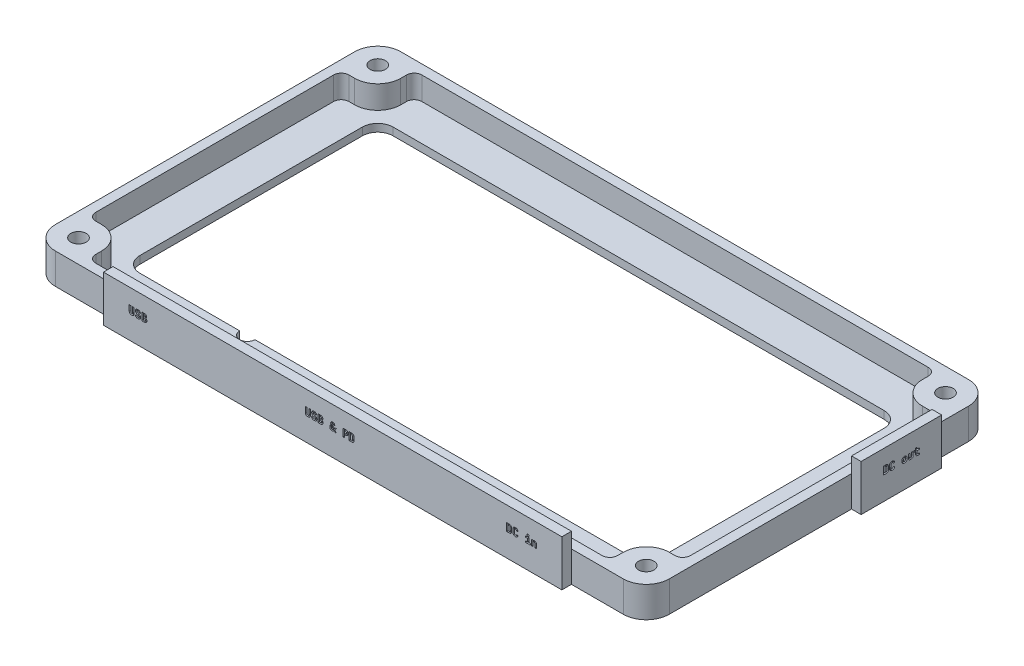
from build123d import *

# Parameters (mm, degrees)
EXTRUDE_1_DEPTH     = 1
EXTRUDE_2_DEPTH     = 3
CUT_EXTRUDE_1_REACH = 93.875
SKETCH_5_R          = 1
SKETCH_6_R          = 2
CUT_EXTRUDE_2_DEPTH = 1.5
SKETCH_7_W          = 59.75
SKETCH_7_H          = 1.25
SKETCH_7_W_2        = 1.25
SKETCH_7_H_2        = 10.5
EXTRUDE_3_DEPTH     = 6
CUT_EXTRUDE_3_REACH = 95.684
CUT_EXTRUDE_4_DEPTH = 0.2
CUT_EXTRUDE_5_DEPTH = 0.2
CUT_EXTRUDE_6_REACH = 95.625
SKETCH_12_R         = 1


with BuildPart() as part:
    # 草图2 → 凸台-拉伸1 (new body)
    with BuildSketch(Plane(origin=(0, 0, 0), x_dir=(1, 0, 0), z_dir=(0, 1, 0))):
        with BuildLine():
            Line((3, 0), (77, 0))
            ThreePointArc((77, 0), (79.121320344, -0.878679656), (80, -3))
            Line((80, -3), (80, -42))
            ThreePointArc((80, -42), (79.121320344, -44.121320344), (77, -45))
            Line((77, -45), (3, -45))
            ThreePointArc((3, -45), (0.878679656, -44.121320344), (0, -42))
            Line((0, -42), (0, -3))
            ThreePointArc((0, -3), (0.878679656, -0.878679656), (3, 0))
        make_face()
    extrude(amount=EXTRUDE_1_DEPTH)

    # 草图3 → 凸台-拉伸2 (add)
    with BuildSketch(Plane(origin=(0, 1, 0), x_dir=(1, 0, 0), z_dir=(0, 1, 0))):
        with BuildLine():
            Line((74, 0), (77, 0))
            ThreePointArc((77, 0), (79.121320344, -0.878679656), (80, -3))
            Line((80, -3), (80, -6))
            Line((80, -6), (80, -39))
            Line((80, -39), (80, -42))
            ThreePointArc((80, -42), (79.121320344, -44.121320344), (77, -45))
            Line((77, -45), (74, -45))
            Line((74, -45), (6, -45))
            Line((6, -45), (3, -45))
            ThreePointArc((3, -45), (0.878679656, -44.121320344), (0, -42))
            Line((0, -42), (0, -39))
            Line((0, -39), (0, -6))
            Line((0, -6), (0, -3))
            ThreePointArc((0, -3), (0.878679656, -0.878679656), (3, 0))
            Line((3, 0), (6, 0))
            Line((6, 0), (74, 0))
        make_face()
        with BuildLine():
            Line((6, -3), (6, -2.25))
            ThreePointArc((6, -2.25), (6.292893219, -1.542893219), (7, -1.25))
            Line((7, -1.25), (73, -1.25))
            ThreePointArc((73, -1.25), (73.707106781, -1.542893219), (74, -2.25))
            Line((74, -2.25), (74, -3))
            ThreePointArc((74, -3), (74.878679656, -5.121320344), (77, -6))
            Line((77, -6), (77.75, -6))
            ThreePointArc((77.75, -6), (78.457106781, -6.292893219), (78.75, -7))
            Line((78.75, -7), (78.75, -38))
            ThreePointArc((78.75, -38), (78.457106781, -38.707106781), (77.75, -39))
            Line((77.75, -39), (77, -39))
            ThreePointArc((77, -39), (74.878679656, -39.878679656), (74, -42))
            Line((74, -42), (74, -42.75))
            ThreePointArc((74, -42.75), (73.707106781, -43.457106781), (73, -43.75))
            Line((73, -43.75), (7, -43.75))
            ThreePointArc((7, -43.75), (6.292893219, -43.457106781), (6, -42.75))
            Line((6, -42.75), (6, -42))
            ThreePointArc((6, -42), (5.121320344, -39.878679656), (3, -39))
            Line((3, -39), (2.25, -39))
            ThreePointArc((2.25, -39), (1.542893219, -38.707106781), (1.25, -38))
            Line((1.25, -38), (1.25, -7))
            ThreePointArc((1.25, -7), (1.542893219, -6.292893219), (2.25, -6))
            Line((2.25, -6), (3, -6))
            ThreePointArc((3, -6), (5.121320344, -5.121320344), (6, -3))
        make_face(mode=Mode.SUBTRACT)
    extrude(amount=EXTRUDE_2_DEPTH)

    # 草图5 → 切除-拉伸1 (cut, up to next)
    with BuildSketch(Plane.XZ, mode=Mode.PRIVATE) as cut_extrude_1_sk1:
        with Locations(Location((3, 42, 0), (0, 0, 270))):
            Circle(SKETCH_5_R)
    cut_extrude_1_tool1 = extrude(cut_extrude_1_sk1.sketch, amount=-CUT_EXTRUDE_1_REACH, mode=Mode.PRIVATE) & part.part
    # 草图5 → 切除-拉伸1 (cut, up to next)
    with BuildSketch(Plane.XZ, mode=Mode.PRIVATE) as cut_extrude_1_sk2:
        with Locations(Location((3, 3, 0), (0, 0, 270))):
            Circle(SKETCH_5_R)
    cut_extrude_1_tool2 = extrude(cut_extrude_1_sk2.sketch, amount=-CUT_EXTRUDE_1_REACH, mode=Mode.PRIVATE) & part.part
    # 草图5 → 切除-拉伸1 (cut, up to next)
    with BuildSketch(Plane.XZ, mode=Mode.PRIVATE) as cut_extrude_1_sk3:
        with Locations(Location((77, 3, 0), (0, 0, 270))):
            Circle(SKETCH_5_R)
    cut_extrude_1_tool3 = extrude(cut_extrude_1_sk3.sketch, amount=-CUT_EXTRUDE_1_REACH, mode=Mode.PRIVATE) & part.part
    # 草图5 → 切除-拉伸1 (cut, up to next)
    with BuildSketch(Plane.XZ, mode=Mode.PRIVATE) as cut_extrude_1_sk4:
        with Locations(Location((77, 42, 0), (0, 0, 270))):
            Circle(SKETCH_5_R)
    cut_extrude_1_tool4 = extrude(cut_extrude_1_sk4.sketch, amount=-CUT_EXTRUDE_1_REACH, mode=Mode.PRIVATE) & part.part
    add(cut_extrude_1_tool1.solids().sort_by_distance((3, 0, 42))[0], mode=Mode.SUBTRACT)
    add(cut_extrude_1_tool2.solids().sort_by_distance((3, 0, 3))[0], mode=Mode.SUBTRACT)
    add(cut_extrude_1_tool3.solids().sort_by_distance((77, 0, 3))[0], mode=Mode.SUBTRACT)
    add(cut_extrude_1_tool4.solids().sort_by_distance((77, 0, 42))[0], mode=Mode.SUBTRACT)

    # 草图6 → 切除-拉伸2 (cut)
    with BuildSketch(Plane.XZ):
        with Locations(Location((3, 42, 0), (0, 0, 270))):
            Circle(SKETCH_6_R)
        with Locations(Location((3, 3, 0), (0, 0, 270))):
            Circle(SKETCH_6_R)
        with Locations(Location((77, 42, 0), (0, 0, 270))):
            Circle(SKETCH_6_R)
        with Locations(Location((77, 3, 0), (0, 0, 270))):
            Circle(SKETCH_6_R)
    extrude(amount=-CUT_EXTRUDE_2_DEPTH, mode=Mode.SUBTRACT)

    # 草图7 → 凸台-拉伸3 (add)
    with BuildSketch(Plane.XZ):
        with Locations((40.375, 45.625)):
            Rectangle(SKETCH_7_W, SKETCH_7_H)
        with Locations((80.625, 13)):
            Rectangle(SKETCH_7_W_2, SKETCH_7_H_2)
    extrude(amount=-EXTRUDE_3_DEPTH)

    # 草图9 → 切除-拉伸3 (cut, up to next)
    with BuildSketch(Plane.XZ, mode=Mode.PRIVATE) as cut_extrude_3_sk1:
        with BuildLine():
            Line((8, 39), (72, 39))
            ThreePointArc((72, 39), (73.414213562, 38.414213562), (74, 37))
            Line((74, 37), (74, 8))
            ThreePointArc((74, 8), (73.414213562, 6.585786438), (72, 6))
            Line((72, 6), (8, 6))
            ThreePointArc((8, 6), (6.585786438, 6.585786438), (6, 8))
            Line((6, 8), (6, 37))
            ThreePointArc((6, 37), (6.585786438, 38.414213562), (8, 39))
        make_face()
    cut_extrude_3_tool1 = extrude(cut_extrude_3_sk1.sketch, amount=-CUT_EXTRUDE_3_REACH, mode=Mode.PRIVATE) & part.part
    add(cut_extrude_3_tool1.solids().sort_by_distance((40, 0, 22.5))[0], mode=Mode.SUBTRACT)

    # 草图10 → 切除-拉伸4 (cut)
    # profile 1 of 14: a face of its own
    with BuildSketch(Plane.XY.offset(46.25)):
        with BuildLine():
            add(Edge.make_bspline(
                [(14.186328125, 2.9875), (14.17414511, 2.987786141), (14.150372448, 2.988344488), (14.115660099, 2.992003358), (14.082980288, 2.99842292), (14.052245665, 3.007446698), (14.023449597, 3.018976733), (13.996471084, 3.032974233), (13.971815758, 3.050060867), (13.948843914, 3.069011197), (13.928564312, 3.090660729), (13.910655978, 3.114064196), (13.895767669, 3.139590837), (13.883349324, 3.166759324), (13.874050226, 3.195978876), (13.86720131, 3.226952581), (13.86304988, 3.259848675), (13.8625568, 3.282409779), (13.862304687, 3.293945313)],
                knots=[0, 0, 0, 0, 1.158464978, 2.260507518, 3.314339669, 4.321193662, 5.301783911, 6.259897935, 7.204293837, 8.149115741, 9.086260426, 10.018587592, 10.945472873, 11.890233932, 12.853434422, 13.85527057, 14.90339589, 16, 16, 16, 16], degree=3))
            Line((13.862304687, 3.293945313), (13.862304687, 4))
            Line((13.862304687, 4), (14.06484375, 4))
            Line((14.06484375, 4), (14.06484375, 3.29453125))
            add(Edge.make_bspline(
                [(14.06484375, 3.29453125), (14.065135347, 3.284593356), (14.0656865, 3.265809507), (14.072007995, 3.239491749), (14.081519314, 3.216505573), (14.095766302, 3.197481069), (14.113689234, 3.182612494), (14.135001296, 3.171796375), (14.15968347, 3.165597306), (14.177177928, 3.164846055), (14.186328125, 3.164453125)],
                knots=[0, 0, 0, 0, 1.175681893, 2.222184267, 3.190024626, 4.105388371, 5.009588527, 5.927746291, 6.916140802, 8, 8, 8, 8], degree=3))
            add(Edge.make_bspline(
                [(14.186328125, 3.164453125), (14.195284831, 3.16484587), (14.212460936, 3.165599029), (14.236790124, 3.171870447), (14.258022619, 3.182652137), (14.276102214, 3.19751786), (14.290716099, 3.21646574), (14.300737688, 3.239401792), (14.306939739, 3.265820804), (14.30751052, 3.284597265), (14.3078125, 3.29453125)],
                knots=[0, 0, 0, 0, 1.062969614, 2.038436794, 2.958491776, 3.870515181, 4.797113145, 5.773223966, 6.82188876, 8, 8, 8, 8], degree=3))
            Line((14.3078125, 3.29453125), (14.3078125, 4))
            Line((14.3078125, 4), (14.51015625, 4))
            Line((14.51015625, 4), (14.51015625, 3.293945313))
            add(Edge.make_bspline(
                [(14.51015625, 3.293945313), (14.509907315, 3.282474522), (14.509421904, 3.260107077), (14.50524555, 3.227472908), (14.49837866, 3.196702364), (14.489143518, 3.16759473), (14.476689978, 3.140455293), (14.461553323, 3.115169715), (14.443892973, 3.091468236), (14.423404073, 3.069962724), (14.400699304, 3.050478214), (14.375786346, 3.033718722), (14.349042093, 3.019355777), (14.320342807, 3.007534905), (14.289531787, 2.998651823), (14.256852983, 2.992270086), (14.222233997, 2.988267015), (14.198513772, 2.987760308), (14.186328125, 2.9875)],
                knots=[0, 0, 0, 0, 1.091993602, 2.129330791, 3.126562285, 4.091154281, 5.031636995, 5.96302358, 6.892964714, 7.84022742, 8.785682817, 9.736570047, 10.693501112, 11.67209694, 12.686353494, 13.741708083, 14.839861423, 16, 16, 16, 16], degree=3))
        make_face()
    # profile 2 of 14: a face of its own
    with BuildSketch(Plane.XY.offset(46.25)):
        with BuildLine():
            add(Edge.make_bspline(
                [(15.001367187, 2.9875), (14.984545747, 2.987934738), (14.951928012, 2.988777719), (14.904566622, 2.995736192), (14.860499595, 3.007143343), (14.819843879, 3.023134627), (14.783100752, 3.043465616), (14.750583583, 3.067873731), (14.722249551, 3.096006759), (14.702723653, 3.122731447), (14.689351643, 3.145630933), (14.680819945, 3.163771133), (14.673644293, 3.182609004), (14.667386781, 3.202036499), (14.663081947, 3.222354488), (14.659750873, 3.243341917), (14.657445744, 3.265053332), (14.65730037, 3.279811679), (14.657226562, 3.287304688)],
                knots=[0, 0, 0, 0, 1.569044635, 3.042467164, 4.455554656, 5.808153274, 7.108047298, 8.361928049, 9.590490884, 10.820119665, 11.438010261, 12.063027174, 12.688044087, 13.318265031, 13.965331043, 14.623509087, 15.301137233, 16, 16, 16, 16], degree=3))
            Line((14.657226562, 3.287304688), (14.854296875, 3.287304688))
            add(Edge.make_bspline(
                [(14.854296875, 3.287304688), (14.854383987, 3.282739101), (14.854554093, 3.273823681), (14.856630842, 3.260812647), (14.859711525, 3.2485042), (14.863971097, 3.236840515), (14.869773411, 3.22604272), (14.87657663, 3.215843839), (14.884721218, 3.206354458), (14.897238082, 3.194644701), (14.915659652, 3.182236676), (14.941263461, 3.171876752), (14.970204702, 3.165566427), (14.990655975, 3.164835791), (15.001367187, 3.164453125)],
                knots=[0, 0, 0, 0, 0.760946038, 1.485932563, 2.191877293, 2.875755776, 3.551042589, 4.231809374, 4.917410476, 5.631990937, 7.086917843, 8.591544583, 10.214845104, 12, 12, 12, 12], degree=3))
            add(Edge.make_bspline(
                [(15.001367187, 3.164453125), (15.011818474, 3.164766961), (15.031745247, 3.165365331), (15.059810749, 3.171503887), (15.084437816, 3.181368636), (15.105013401, 3.195632849), (15.121504593, 3.213205783), (15.133527377, 3.233716378), (15.140542265, 3.25710826), (15.141368402, 3.273519574), (15.141796875, 3.28203125)],
                knots=[0, 0, 0, 0, 1.212285081, 2.311383436, 3.31829787, 4.274826978, 5.19509796, 6.096502946, 7.01275723, 8, 8, 8, 8], degree=3))
            add(Edge.make_bspline(
                [(15.141796875, 3.28203125), (15.141491601, 3.288956525), (15.140891651, 3.302566646), (15.136285038, 3.322389205), (15.128522075, 3.341041366), (15.117793977, 3.358316895), (15.104398238, 3.374030415), (15.087523643, 3.386629999), (15.067980396, 3.39660601), (15.05354437, 3.400519341), (15.04609375, 3.402539063)],
                knots=[0, 0, 0, 0, 0.99462839, 1.954725567, 2.906948459, 3.885873305, 4.867299059, 5.855392485, 6.893140328, 8, 8, 8, 8], degree=3))
            Line((15.04609375, 3.402539063), (14.92578125, 3.43125))
            add(Edge.make_bspline(
                [(14.92578125, 3.43125), (14.916304257, 3.43365936), (14.897685757, 3.43839279), (14.870822037, 3.447600555), (14.845531462, 3.458604904), (14.821726895, 3.471107435), (14.799260259, 3.48495099), (14.77845663, 3.500705626), (14.759184292, 3.518083736), (14.741345374, 3.536830849), (14.725365596, 3.556872841), (14.711424249, 3.578046062), (14.699645269, 3.600211518), (14.690043971, 3.623363673), (14.6825713, 3.647492622), (14.677433372, 3.672555207), (14.673854633, 3.698530132), (14.673578243, 3.716198323), (14.6734375, 3.725195313)],
                knots=[0, 0, 0, 0, 1.115738474, 2.191979884, 3.23695961, 4.260666819, 5.258619181, 6.245415913, 7.234615722, 8.21751599, 9.195799034, 10.156196262, 11.106885838, 12.056296824, 13.01289208, 13.984946844, 14.973895441, 16, 16, 16, 16], degree=3))
            add(Edge.make_bspline(
                [(14.6734375, 3.725195313), (14.673710004, 3.736078277), (14.674242154, 3.757330757), (14.678102959, 3.788371113), (14.684958312, 3.817539605), (14.694435796, 3.844932666), (14.706225563, 3.870716436), (14.721235372, 3.894415005), (14.738830217, 3.916322736), (14.758899102, 3.936410058), (14.78141227, 3.954353287), (14.805876187, 3.970030926), (14.832339212, 3.983220615), (14.860760351, 3.993923702), (14.891166523, 4.002298562), (14.923496695, 4.008347511), (14.957799406, 4.011856832), (14.981306933, 4.012282009), (14.993359375, 4.0125)],
                knots=[0, 0, 0, 0, 1.073091475, 2.09555532, 3.078181108, 4.022279257, 4.950016804, 5.867366777, 6.780776854, 7.715948456, 8.66144262, 9.614232304, 10.576063576, 11.571690491, 12.604382639, 13.682226399, 14.811664407, 16, 16, 16, 16], degree=3))
            add(Edge.make_bspline(
                [(14.993359375, 4.0125), (15.005413876, 4.012301985), (15.028997013, 4.011914594), (15.063341895, 4.008110661), (15.095806183, 4.002087265), (15.126430417, 3.993719752), (15.155215507, 3.982868183), (15.181961946, 3.96921229), (15.20686829, 3.953389241), (15.22978421, 3.935251796), (15.250187305, 3.914882548), (15.268484787, 3.893005116), (15.28340873, 3.868922168), (15.29608949, 3.843501548), (15.30569476, 3.816196708), (15.312432874, 3.787246987), (15.316652227, 3.756568967), (15.317135418, 3.735560845), (15.317382812, 3.724804688)],
                knots=[0, 0, 0, 0, 1.182400679, 2.313220369, 3.385681045, 4.419372537, 5.42423907, 6.398424207, 7.360660871, 8.31540456, 9.25946742, 10.185352333, 11.106930113, 12.03255055, 12.968015841, 13.939516459, 14.945032523, 16, 16, 16, 16], degree=3))
            Line((15.317382812, 3.724804688), (15.1203125, 3.724804688))
            add(Edge.make_bspline(
                [(15.1203125, 3.724804688), (15.119929425, 3.733052469), (15.119196466, 3.74883341), (15.112791076, 3.771138449), (15.102084043, 3.790625512), (15.086833087, 3.806809506), (15.068086838, 3.819840948), (15.045886838, 3.828947754), (15.020678221, 3.834802955), (15.002770308, 3.835290606), (14.993359375, 3.835546875)],
                knots=[0, 0, 0, 0, 1.03715309, 1.984442937, 2.894811091, 3.811619525, 4.760186234, 5.748640091, 6.816869461, 8, 8, 8, 8], degree=3))
            add(Edge.make_bspline(
                [(14.993359375, 3.835546875), (14.984211782, 3.835268153), (14.966775154, 3.834736868), (14.942201947, 3.829153655), (14.920648557, 3.82026619), (14.902658267, 3.807533155), (14.888005872, 3.792068397), (14.878036691, 3.773474683), (14.871384048, 3.75279245), (14.870806404, 3.738075905), (14.870507812, 3.73046875)],
                knots=[0, 0, 0, 0, 1.201557724, 2.290341742, 3.295757454, 4.248616704, 5.169888421, 6.070830286, 7.002789508, 8, 8, 8, 8], degree=3))
            add(Edge.make_bspline(
                [(14.870507812, 3.73046875), (14.870710261, 3.724250546), (14.871101908, 3.71222115), (14.875837061, 3.695162507), (14.883076219, 3.679756337), (14.893509344, 3.666234863), (14.906875085, 3.654562792), (14.923226465, 3.644860808), (14.942275137, 3.636513385), (14.956312618, 3.632932168), (14.963671875, 3.631054688)],
                knots=[0, 0, 0, 0, 0.999013644, 1.932636913, 2.828566671, 3.726335996, 4.662606178, 5.669843198, 6.778397397, 8, 8, 8, 8], degree=3))
            Line((14.963671875, 3.631054688), (15.087890625, 3.60234375))
            add(Edge.make_bspline(
                [(15.087890625, 3.60234375), (15.097368328, 3.600007416), (15.116003877, 3.595413596), (15.142937002, 3.586253028), (15.168174612, 3.574765845), (15.192135429, 3.561767966), (15.214420021, 3.546624011), (15.235359064, 3.529733987), (15.254621044, 3.510749003), (15.272409693, 3.490051746), (15.288342546, 3.467890657), (15.302271606, 3.444569421), (15.31408405, 3.420210396), (15.323663702, 3.394708866), (15.331123169, 3.368044017), (15.336252082, 3.340255431), (15.339804209, 3.311484756), (15.340089685, 3.291938167), (15.340234375, 3.28203125)],
                knots=[0, 0, 0, 0, 1.056900111, 2.078131398, 3.07539817, 4.056785644, 5.02675947, 5.989195358, 6.966445526, 7.951473587, 8.941611126, 9.918657785, 10.889937698, 11.869499805, 12.865145105, 13.884305348, 14.927689646, 16, 16, 16, 16], degree=3))
            add(Edge.make_bspline(
                [(15.340234375, 3.28203125), (15.340139996, 3.274735081), (15.339954251, 3.26037576), (15.337940326, 3.23916724), (15.334628841, 3.21868853), (15.330079637, 3.198873482), (15.324568987, 3.179648289), (15.31716586, 3.161276522), (15.308839168, 3.14348834), (15.299225869, 3.126459394), (15.288510035, 3.110233427), (15.276574952, 3.094931358), (15.263367567, 3.08071923), (15.249410689, 3.067111848), (15.233965985, 3.054841844), (15.217684939, 3.043278786), (15.200092538, 3.032940229), (15.175235481, 3.020040358), (15.141444595, 3.006766138), (15.097847676, 2.995480885), (15.050724426, 2.988831001), (15.018185838, 2.987953543), (15.001367187, 2.9875)],
                knots=[0, 0, 0, 0, 0.863975747, 1.700358937, 2.520589361, 3.319370218, 4.107471455, 4.886465777, 5.662592273, 6.432565042, 7.200372355, 7.963947154, 8.728027979, 9.497034781, 10.270205909, 11.061770352, 11.860551209, 12.684831464, 14.377405458, 16.14677573, 18.00833291, 20, 20, 20, 20], degree=3))
        make_face()
    # profile 3 of 14: a face of its own
    with BuildSketch(Plane.XY.offset(46.25)):
        with BuildLine():
            Line((15.4953125, 3), (15.4953125, 4))
            Line((15.4953125, 4), (15.812695312, 4))
            add(Edge.make_bspline(
                [(15.812695312, 4), (15.828600947, 3.999662992), (15.859493392, 3.999008444), (15.904269102, 3.99286324), (15.945921238, 3.982767569), (15.984323601, 3.968728186), (16.019180428, 3.951139564), (16.05042233, 3.930514521), (16.077209747, 3.906119276), (16.096358596, 3.883454576), (16.109148152, 3.863808996), (16.117609199, 3.848488181), (16.124849001, 3.83259402), (16.130555205, 3.815889543), (16.134956567, 3.798631838), (16.138361755, 3.7807086), (16.140334468, 3.762154352), (16.140527319, 3.749548883), (16.140625, 3.743164063)],
                knots=[0, 0, 0, 0, 1.634104897, 3.173812147, 4.63446838, 6.031701666, 7.366390114, 8.639541255, 9.866575899, 11.078039246, 11.677520016, 12.273517471, 12.875495234, 13.470138831, 14.085250595, 14.704714619, 15.343922492, 16, 16, 16, 16], degree=3))
            add(Edge.make_bspline(
                [(16.140625, 3.743164063), (16.140466315, 3.736257145), (16.140154156, 3.722670166), (16.137955029, 3.702759838), (16.134505366, 3.683660274), (16.12940663, 3.665504331), (16.122902892, 3.648207869), (16.115162834, 3.631707725), (16.105644753, 3.61624128), (16.094982123, 3.60163128), (16.083151076, 3.588217882), (16.070273437, 3.576200544), (16.05677964, 3.565460868), (16.04218009, 3.556352206), (16.02690799, 3.548575743), (16.010670547, 3.542285669), (15.993675405, 3.537356987), (15.981924101, 3.535247391), (15.975976562, 3.534179688)],
                knots=[0, 0, 0, 0, 1.136962117, 2.236580989, 3.294017969, 4.329054202, 5.336415468, 6.333632658, 7.324435324, 8.321306838, 9.308450285, 10.263894671, 11.218075679, 12.142909032, 13.09201971, 14.035485025, 15.005724885, 16, 16, 16, 16], degree=3))
            Line((15.975976562, 3.534179688), (15.975976562, 3.531445313))
            add(Edge.make_bspline(
                [(15.975976562, 3.531445313), (15.984946556, 3.53020107), (16.002718329, 3.527735918), (16.028320563, 3.519617051), (16.052155352, 3.507685208), (16.074266532, 3.49259939), (16.094331825, 3.474592696), (16.112205104, 3.45421714), (16.127578066, 3.431397062), (16.140591695, 3.406524197), (16.151005608, 3.379612772), (16.158402199, 3.351045426), (16.16271971, 3.320899483), (16.163350078, 3.300339447), (16.163671875, 3.28984375)],
                knots=[0, 0, 0, 0, 0.969027313, 1.919882564, 2.861998151, 3.815842355, 4.779204044, 5.743171654, 6.712475104, 7.720270347, 8.744943746, 9.797307777, 10.875547206, 12, 12, 12, 12], degree=3))
            add(Edge.make_bspline(
                [(16.163671875, 3.28984375), (16.1635964, 3.282741102), (16.16344716, 3.268696827), (16.161146575, 3.248026145), (16.157826227, 3.228009907), (16.153464472, 3.208616034), (16.147306916, 3.189974855), (16.139833289, 3.172007049), (16.131312939, 3.154558068), (16.117938324, 3.132426083), (16.098374718, 3.106629643), (16.070470722, 3.07915696), (16.038268913, 3.055408077), (16.002137897, 3.035314413), (15.962275847, 3.019499584), (15.91918762, 3.008252783), (15.873012186, 3.001286895), (15.841171167, 3.000436902), (15.824804687, 3)],
                knots=[0, 0, 0, 0, 0.680533559, 1.345638896, 1.991008345, 2.625328893, 3.248998241, 3.870227094, 4.489855041, 5.108507864, 6.346757563, 7.582456666, 8.849407981, 10.170893362, 11.53496205, 12.948876387, 14.431703753, 16, 16, 16, 16], degree=3))
            Line((15.824804687, 3), (15.4953125, 3))
        make_face()
        with BuildLine():
            Line((15.691015625, 3.6), (15.809960937, 3.6))
            add(Edge.make_bspline(
                [(15.809960937, 3.6), (15.819373097, 3.600314792), (15.837309447, 3.600914679), (15.86265318, 3.60707758), (15.884789273, 3.617267419), (15.903466105, 3.631604496), (15.918479591, 3.649284617), (15.929256462, 3.670174714), (15.935583916, 3.693971704), (15.936329645, 3.710767551), (15.93671875, 3.71953125)],
                knots=[0, 0, 0, 0, 1.144796009, 2.181588789, 3.153727355, 4.092790809, 5.027019237, 5.956387483, 6.933688455, 8, 8, 8, 8], degree=3))
            add(Edge.make_bspline(
                [(15.93671875, 3.71953125), (15.936330827, 3.728424344), (15.935589811, 3.745412058), (15.929321984, 3.769363468), (15.918570752, 3.790131483), (15.903427154, 3.80730166), (15.884694439, 3.821000577), (15.862622328, 3.830846855), (15.837256108, 3.836472076), (15.819365049, 3.837145845), (15.809960937, 3.8375)],
                knots=[0, 0, 0, 0, 1.08567023, 2.073862809, 2.999224927, 3.918408742, 4.846230662, 5.814914009, 6.85144908, 8, 8, 8, 8], degree=3))
            Line((15.809960937, 3.8375), (15.691015625, 3.8375))
            Line((15.691015625, 3.8375), (15.691015625, 3.6))
        make_face(mode=Mode.SUBTRACT)
        with BuildLine():
            Line((15.691015625, 3.1625), (15.81796875, 3.1625))
            add(Edge.make_bspline(
                [(15.81796875, 3.1625), (15.823313859, 3.16259998), (15.833773652, 3.162795631), (15.849028529, 3.164691926), (15.863545164, 3.167219129), (15.877015951, 3.171460587), (15.889654798, 3.176443176), (15.901215374, 3.182833523), (15.912136578, 3.190049587), (15.922025263, 3.198603599), (15.930789355, 3.208280078), (15.938706623, 3.218554156), (15.945202361, 3.229967621), (15.950642001, 3.242112921), (15.954771785, 3.255230388), (15.957650348, 3.269102456), (15.959458231, 3.28387176), (15.959661196, 3.294005003), (15.959765625, 3.29921875)],
                knots=[0, 0, 0, 0, 1.148615115, 2.247713982, 3.301951168, 4.311565236, 5.278551795, 6.218096863, 7.145994879, 8.08887094, 9.020141608, 9.949622079, 10.871588266, 11.836647847, 12.806164067, 13.82196977, 14.879361973, 16, 16, 16, 16], degree=3))
            add(Edge.make_bspline(
                [(15.959765625, 3.29921875), (15.959657072, 3.304431895), (15.959444746, 3.31462863), (15.957676778, 3.329470018), (15.954732382, 3.343454898), (15.950692375, 3.356667265), (15.945151182, 3.368899317), (15.938707793, 3.380457967), (15.930856858, 3.390928107), (15.921961322, 3.400611332), (15.912151511, 3.409363357), (15.901222532, 3.416779282), (15.889655882, 3.423326739), (15.877098372, 3.428655202), (15.863476116, 3.432444032), (15.849062382, 3.435401784), (15.833767924, 3.437178894), (15.823311922, 3.437391404), (15.81796875, 3.4375)],
                knots=[0, 0, 0, 0, 1.115166586, 2.181228, 3.1920741, 4.170139897, 5.130487639, 6.060033796, 6.99613236, 7.922856161, 8.870286803, 9.801501431, 10.743180056, 11.710774289, 12.711491898, 13.763260333, 14.856992922, 16, 16, 16, 16], degree=3))
            Line((15.81796875, 3.4375), (15.691015625, 3.4375))
            Line((15.691015625, 3.4375), (15.691015625, 3.1625))
        make_face(mode=Mode.SUBTRACT)
    # profile 4 of 14: a face of its own
    with BuildSketch(Plane.XY.offset(46.25)):
        with BuildLine():
            add(Edge.make_bspline(
                [(37.155078125, 2.9875), (37.14289511, 2.987786141), (37.119122448, 2.988344488), (37.084410099, 2.992003358), (37.051730288, 2.99842292), (37.020995665, 3.007446698), (36.992199597, 3.018976733), (36.965221084, 3.032974233), (36.940565758, 3.050060867), (36.917593914, 3.069011197), (36.897314312, 3.090660729), (36.879405978, 3.114064196), (36.864517669, 3.139590837), (36.852099324, 3.166759324), (36.842800226, 3.195978876), (36.83595131, 3.226952581), (36.83179988, 3.259848675), (36.8313068, 3.282409779), (36.831054687, 3.293945313)],
                knots=[0, 0, 0, 0, 1.158464978, 2.260507518, 3.314339669, 4.321193662, 5.301783911, 6.259897935, 7.204293837, 8.149115741, 9.086260426, 10.018587592, 10.945472873, 11.890233932, 12.853434422, 13.85527057, 14.90339589, 16, 16, 16, 16], degree=3))
            Line((36.831054687, 3.293945313), (36.831054687, 4))
            Line((36.831054687, 4), (37.03359375, 4))
            Line((37.03359375, 4), (37.03359375, 3.29453125))
            add(Edge.make_bspline(
                [(37.03359375, 3.29453125), (37.033885347, 3.284593356), (37.0344365, 3.265809507), (37.040757995, 3.239491749), (37.050269314, 3.216505573), (37.064516302, 3.197481069), (37.082439234, 3.182612494), (37.103751296, 3.171796375), (37.12843347, 3.165597306), (37.145927928, 3.164846055), (37.155078125, 3.164453125)],
                knots=[0, 0, 0, 0, 1.175681893, 2.222184267, 3.190024626, 4.105388371, 5.009588527, 5.927746291, 6.916140802, 8, 8, 8, 8], degree=3))
            add(Edge.make_bspline(
                [(37.155078125, 3.164453125), (37.164034831, 3.16484587), (37.181210936, 3.165599029), (37.205540124, 3.171870447), (37.226772619, 3.182652137), (37.244852214, 3.19751786), (37.259466099, 3.21646574), (37.269487688, 3.239401792), (37.275689739, 3.265820804), (37.27626052, 3.284597265), (37.2765625, 3.29453125)],
                knots=[0, 0, 0, 0, 1.062969614, 2.038436794, 2.958491776, 3.870515181, 4.797113145, 5.773223966, 6.82188876, 8, 8, 8, 8], degree=3))
            Line((37.2765625, 3.29453125), (37.2765625, 4))
            Line((37.2765625, 4), (37.47890625, 4))
            Line((37.47890625, 4), (37.47890625, 3.293945313))
            add(Edge.make_bspline(
                [(37.47890625, 3.293945313), (37.478657315, 3.282474522), (37.478171904, 3.260107077), (37.47399555, 3.227472908), (37.467128661, 3.196702364), (37.457893518, 3.16759473), (37.445439978, 3.140455293), (37.430303323, 3.115169715), (37.412642973, 3.091468236), (37.392154073, 3.069962724), (37.369449304, 3.050478214), (37.344536346, 3.033718722), (37.317792093, 3.019355777), (37.289092807, 3.007534905), (37.258281787, 2.998651823), (37.225602983, 2.992270086), (37.190983997, 2.988267015), (37.167263772, 2.987760308), (37.155078125, 2.9875)],
                knots=[0, 0, 0, 0, 1.091993602, 2.129330791, 3.126562285, 4.091154281, 5.031636995, 5.96302358, 6.892964714, 7.84022742, 8.785682817, 9.736570047, 10.693501112, 11.67209694, 12.686353494, 13.741708083, 14.839861423, 16, 16, 16, 16], degree=3))
        make_face()
    # profile 5 of 14: a face of its own
    with BuildSketch(Plane.XY.offset(46.25)):
        with BuildLine():
            add(Edge.make_bspline(
                [(37.970117187, 2.9875), (37.953295747, 2.987934738), (37.920678012, 2.988777719), (37.873316622, 2.995736192), (37.829249595, 3.007143343), (37.788593879, 3.023134627), (37.751850752, 3.043465616), (37.719333583, 3.067873731), (37.690999551, 3.096006759), (37.671473653, 3.122731447), (37.658101643, 3.145630933), (37.649569945, 3.163771133), (37.642394293, 3.182609004), (37.636136781, 3.202036499), (37.631831947, 3.222354488), (37.628500873, 3.243341917), (37.626195744, 3.265053332), (37.62605037, 3.279811679), (37.625976562, 3.287304688)],
                knots=[0, 0, 0, 0, 1.569044635, 3.042467164, 4.455554656, 5.808153274, 7.108047298, 8.361928049, 9.590490884, 10.820119665, 11.438010261, 12.063027174, 12.688044087, 13.318265031, 13.965331043, 14.623509087, 15.301137233, 16, 16, 16, 16], degree=3))
            Line((37.625976562, 3.287304688), (37.823046875, 3.287304688))
            add(Edge.make_bspline(
                [(37.823046875, 3.287304688), (37.823133987, 3.282739101), (37.823304093, 3.273823681), (37.825380842, 3.260812647), (37.828461525, 3.2485042), (37.832721097, 3.236840515), (37.838523411, 3.22604272), (37.84532663, 3.215843839), (37.853471218, 3.206354458), (37.865988082, 3.194644701), (37.884409652, 3.182236676), (37.910013461, 3.171876752), (37.938954702, 3.165566427), (37.959405975, 3.164835791), (37.970117187, 3.164453125)],
                knots=[0, 0, 0, 0, 0.760946038, 1.485932563, 2.191877293, 2.875755776, 3.551042589, 4.231809374, 4.917410476, 5.631990937, 7.086917843, 8.591544583, 10.214845104, 12, 12, 12, 12], degree=3))
            add(Edge.make_bspline(
                [(37.970117187, 3.164453125), (37.980568474, 3.164766961), (38.000495247, 3.165365331), (38.028560749, 3.171503887), (38.053187816, 3.181368636), (38.073763401, 3.195632849), (38.090254593, 3.213205783), (38.102277377, 3.233716378), (38.109292265, 3.25710826), (38.110118402, 3.273519574), (38.110546875, 3.28203125)],
                knots=[0, 0, 0, 0, 1.212285081, 2.311383436, 3.31829787, 4.274826978, 5.19509796, 6.096502946, 7.01275723, 8, 8, 8, 8], degree=3))
            add(Edge.make_bspline(
                [(38.110546875, 3.28203125), (38.110241601, 3.288956525), (38.109641651, 3.302566646), (38.105035038, 3.322389205), (38.097272075, 3.341041366), (38.086543977, 3.358316895), (38.073148238, 3.374030415), (38.056273644, 3.386629999), (38.036730396, 3.39660601), (38.02229437, 3.400519341), (38.01484375, 3.402539063)],
                knots=[0, 0, 0, 0, 0.99462839, 1.954725567, 2.906948459, 3.885873305, 4.867299059, 5.855392485, 6.893140328, 8, 8, 8, 8], degree=3))
            Line((38.01484375, 3.402539063), (37.89453125, 3.43125))
            add(Edge.make_bspline(
                [(37.89453125, 3.43125), (37.885054257, 3.43365936), (37.866435757, 3.43839279), (37.839572037, 3.447600555), (37.814281462, 3.458604904), (37.790476895, 3.471107435), (37.768010259, 3.48495099), (37.747206631, 3.500705626), (37.727934292, 3.518083736), (37.710095374, 3.536830849), (37.694115596, 3.556872841), (37.680174249, 3.578046062), (37.668395269, 3.600211518), (37.658793971, 3.623363673), (37.6513213, 3.647492622), (37.646183372, 3.672555207), (37.642604633, 3.698530132), (37.642328243, 3.716198323), (37.6421875, 3.725195313)],
                knots=[0, 0, 0, 0, 1.115738474, 2.191979884, 3.23695961, 4.260666819, 5.258619181, 6.245415913, 7.234615722, 8.21751599, 9.195799034, 10.156196262, 11.106885838, 12.056296824, 13.01289208, 13.984946844, 14.973895441, 16, 16, 16, 16], degree=3))
            add(Edge.make_bspline(
                [(37.6421875, 3.725195313), (37.642460004, 3.736078277), (37.642992154, 3.757330757), (37.646852959, 3.788371113), (37.653708312, 3.817539605), (37.663185796, 3.844932666), (37.674975563, 3.870716436), (37.689985372, 3.894415005), (37.707580217, 3.916322736), (37.727649102, 3.936410058), (37.75016227, 3.954353287), (37.774626187, 3.970030926), (37.801089212, 3.983220615), (37.829510351, 3.993923702), (37.859916523, 4.002298562), (37.892246695, 4.008347511), (37.926549406, 4.011856832), (37.950056933, 4.012282009), (37.962109375, 4.0125)],
                knots=[0, 0, 0, 0, 1.073091475, 2.09555532, 3.078181108, 4.022279257, 4.950016804, 5.867366777, 6.780776854, 7.715948456, 8.66144262, 9.614232304, 10.576063576, 11.571690491, 12.604382639, 13.682226399, 14.811664407, 16, 16, 16, 16], degree=3))
            add(Edge.make_bspline(
                [(37.962109375, 4.0125), (37.974163876, 4.012301985), (37.997747013, 4.011914594), (38.032091895, 4.008110661), (38.064556183, 4.002087265), (38.095180417, 3.993719752), (38.123965507, 3.982868183), (38.150711946, 3.96921229), (38.17561829, 3.953389241), (38.19853421, 3.935251796), (38.218937305, 3.914882548), (38.237234787, 3.893005116), (38.25215873, 3.868922168), (38.26483949, 3.843501548), (38.27444476, 3.816196708), (38.281182874, 3.787246987), (38.285402227, 3.756568967), (38.285885419, 3.735560845), (38.286132812, 3.724804688)],
                knots=[0, 0, 0, 0, 1.182400679, 2.313220369, 3.385681045, 4.419372537, 5.42423907, 6.398424207, 7.360660871, 8.31540456, 9.25946742, 10.185352333, 11.106930113, 12.03255055, 12.968015841, 13.939516459, 14.945032523, 16, 16, 16, 16], degree=3))
            Line((38.286132812, 3.724804688), (38.0890625, 3.724804688))
            add(Edge.make_bspline(
                [(38.0890625, 3.724804688), (38.088679425, 3.733052469), (38.087946466, 3.74883341), (38.081541076, 3.771138449), (38.070834043, 3.790625512), (38.055583087, 3.806809506), (38.036836838, 3.819840948), (38.014636838, 3.828947754), (37.989428221, 3.834802955), (37.971520308, 3.835290606), (37.962109375, 3.835546875)],
                knots=[0, 0, 0, 0, 1.03715309, 1.984442937, 2.894811091, 3.811619525, 4.760186234, 5.748640091, 6.816869461, 8, 8, 8, 8], degree=3))
            add(Edge.make_bspline(
                [(37.962109375, 3.835546875), (37.952961782, 3.835268153), (37.935525154, 3.834736868), (37.910951947, 3.829153655), (37.889398557, 3.82026619), (37.871408267, 3.807533155), (37.856755872, 3.792068397), (37.846786691, 3.773474683), (37.840134048, 3.75279245), (37.839556404, 3.738075905), (37.839257812, 3.73046875)],
                knots=[0, 0, 0, 0, 1.201557724, 2.290341742, 3.295757454, 4.248616704, 5.169888421, 6.070830286, 7.002789508, 8, 8, 8, 8], degree=3))
            add(Edge.make_bspline(
                [(37.839257812, 3.73046875), (37.839460261, 3.724250546), (37.839851908, 3.71222115), (37.844587061, 3.695162507), (37.851826219, 3.679756337), (37.862259344, 3.666234863), (37.875625085, 3.654562792), (37.891976465, 3.644860808), (37.911025137, 3.636513385), (37.925062618, 3.632932168), (37.932421875, 3.631054688)],
                knots=[0, 0, 0, 0, 0.999013644, 1.932636913, 2.828566671, 3.726335996, 4.662606178, 5.669843198, 6.778397397, 8, 8, 8, 8], degree=3))
            Line((37.932421875, 3.631054688), (38.056640625, 3.60234375))
            add(Edge.make_bspline(
                [(38.056640625, 3.60234375), (38.066118328, 3.600007416), (38.084753877, 3.595413596), (38.111687002, 3.586253028), (38.136924612, 3.574765845), (38.160885429, 3.561767966), (38.183170021, 3.546624011), (38.204109064, 3.529733987), (38.223371044, 3.510749003), (38.241159693, 3.490051746), (38.257092546, 3.467890657), (38.271021606, 3.444569421), (38.28283405, 3.420210396), (38.292413702, 3.394708866), (38.299873169, 3.368044017), (38.305002082, 3.340255431), (38.308554209, 3.311484756), (38.308839685, 3.291938167), (38.308984375, 3.28203125)],
                knots=[0, 0, 0, 0, 1.056900111, 2.078131398, 3.07539817, 4.056785644, 5.02675947, 5.989195358, 6.966445526, 7.951473587, 8.941611126, 9.918657785, 10.889937698, 11.869499805, 12.865145105, 13.884305348, 14.927689646, 16, 16, 16, 16], degree=3))
            add(Edge.make_bspline(
                [(38.308984375, 3.28203125), (38.308889996, 3.274735081), (38.308704251, 3.26037576), (38.306690326, 3.23916724), (38.303378841, 3.21868853), (38.298829637, 3.198873482), (38.293318987, 3.179648289), (38.28591586, 3.161276522), (38.277589168, 3.14348834), (38.267975869, 3.126459394), (38.257260035, 3.110233427), (38.245324952, 3.094931358), (38.232117568, 3.08071923), (38.218160689, 3.067111848), (38.202715985, 3.054841844), (38.186434939, 3.043278786), (38.168842538, 3.032940229), (38.143985481, 3.020040358), (38.110194595, 3.006766138), (38.066597676, 2.995480885), (38.019474426, 2.988831001), (37.986935838, 2.987953543), (37.970117187, 2.9875)],
                knots=[0, 0, 0, 0, 0.863975747, 1.700358937, 2.520589361, 3.319370218, 4.107471455, 4.886465777, 5.662592273, 6.432565042, 7.200372355, 7.963947154, 8.728027979, 9.497034781, 10.270205909, 11.061770352, 11.860551209, 12.684831464, 14.377405458, 16.14677573, 18.00833291, 20, 20, 20, 20], degree=3))
        make_face()
    # profile 6 of 14: a face of its own
    with BuildSketch(Plane.XY.offset(46.25)):
        with BuildLine():
            Line((38.4640625, 3), (38.4640625, 4))
            Line((38.4640625, 4), (38.781445312, 4))
            add(Edge.make_bspline(
                [(38.781445312, 4), (38.797350947, 3.999662992), (38.828243392, 3.999008444), (38.873019102, 3.99286324), (38.914671238, 3.982767569), (38.953073601, 3.968728186), (38.987930428, 3.951139564), (39.01917233, 3.930514521), (39.045959747, 3.906119276), (39.065108596, 3.883454576), (39.077898152, 3.863808996), (39.086359199, 3.848488181), (39.093599001, 3.83259402), (39.099305205, 3.815889543), (39.103706567, 3.798631838), (39.107111755, 3.7807086), (39.109084468, 3.762154352), (39.109277319, 3.749548883), (39.109375, 3.743164063)],
                knots=[0, 0, 0, 0, 1.634104897, 3.173812147, 4.63446838, 6.031701666, 7.366390114, 8.639541255, 9.866575899, 11.078039246, 11.677520016, 12.273517471, 12.875495234, 13.470138831, 14.085250595, 14.704714619, 15.343922492, 16, 16, 16, 16], degree=3))
            add(Edge.make_bspline(
                [(39.109375, 3.743164063), (39.109216315, 3.736257145), (39.108904156, 3.722670166), (39.106705029, 3.702759838), (39.103255366, 3.683660274), (39.09815663, 3.665504331), (39.091652892, 3.648207869), (39.083912834, 3.631707725), (39.074394753, 3.61624128), (39.063732123, 3.60163128), (39.051901076, 3.588217882), (39.039023437, 3.576200544), (39.02552964, 3.565460868), (39.01093009, 3.556352206), (38.99565799, 3.548575743), (38.979420547, 3.542285669), (38.962425405, 3.537356987), (38.950674101, 3.535247391), (38.944726562, 3.534179688)],
                knots=[0, 0, 0, 0, 1.136962117, 2.236580989, 3.294017969, 4.329054202, 5.336415468, 6.333632658, 7.324435324, 8.321306838, 9.308450285, 10.263894671, 11.218075679, 12.142909032, 13.09201971, 14.035485025, 15.005724885, 16, 16, 16, 16], degree=3))
            Line((38.944726562, 3.534179688), (38.944726562, 3.531445313))
            add(Edge.make_bspline(
                [(38.944726562, 3.531445313), (38.953696556, 3.53020107), (38.971468329, 3.527735918), (38.997070563, 3.519617051), (39.020905352, 3.507685208), (39.043016532, 3.49259939), (39.063081825, 3.474592696), (39.080955104, 3.45421714), (39.096328066, 3.431397062), (39.109341695, 3.406524197), (39.119755608, 3.379612772), (39.127152199, 3.351045426), (39.13146971, 3.320899483), (39.132100078, 3.300339447), (39.132421875, 3.28984375)],
                knots=[0, 0, 0, 0, 0.969027313, 1.919882564, 2.861998151, 3.815842355, 4.779204044, 5.743171654, 6.712475104, 7.720270347, 8.744943746, 9.797307777, 10.875547206, 12, 12, 12, 12], degree=3))
            add(Edge.make_bspline(
                [(39.132421875, 3.28984375), (39.1323464, 3.282741102), (39.13219716, 3.268696827), (39.129896575, 3.248026145), (39.126576227, 3.228009907), (39.122214472, 3.208616034), (39.116056916, 3.189974855), (39.108583289, 3.172007049), (39.100062939, 3.154558068), (39.086688324, 3.132426083), (39.067124718, 3.106629643), (39.039220722, 3.07915696), (39.007018913, 3.055408077), (38.970887897, 3.035314413), (38.931025847, 3.019499584), (38.88793762, 3.008252783), (38.841762186, 3.001286895), (38.809921167, 3.000436902), (38.793554687, 3)],
                knots=[0, 0, 0, 0, 0.680533559, 1.345638896, 1.991008345, 2.625328893, 3.248998241, 3.870227094, 4.489855041, 5.108507864, 6.346757563, 7.582456666, 8.849407981, 10.170893362, 11.53496205, 12.948876387, 14.431703753, 16, 16, 16, 16], degree=3))
            Line((38.793554687, 3), (38.4640625, 3))
        make_face()
        with BuildLine():
            Line((38.659765625, 3.6), (38.778710937, 3.6))
            add(Edge.make_bspline(
                [(38.778710937, 3.6), (38.788123097, 3.600314792), (38.806059447, 3.600914679), (38.83140318, 3.60707758), (38.853539273, 3.617267419), (38.872216105, 3.631604496), (38.887229591, 3.649284617), (38.898006463, 3.670174714), (38.904333916, 3.693971704), (38.905079645, 3.710767551), (38.90546875, 3.71953125)],
                knots=[0, 0, 0, 0, 1.144796009, 2.181588789, 3.153727355, 4.092790809, 5.027019237, 5.956387483, 6.933688455, 8, 8, 8, 8], degree=3))
            add(Edge.make_bspline(
                [(38.90546875, 3.71953125), (38.905080827, 3.728424344), (38.904339811, 3.745412058), (38.898071984, 3.769363468), (38.887320752, 3.790131483), (38.872177154, 3.80730166), (38.853444439, 3.821000577), (38.831372328, 3.830846855), (38.806006108, 3.836472076), (38.788115049, 3.837145845), (38.778710937, 3.8375)],
                knots=[0, 0, 0, 0, 1.08567023, 2.073862809, 2.999224927, 3.918408742, 4.846230662, 5.814914009, 6.85144908, 8, 8, 8, 8], degree=3))
            Line((38.778710937, 3.8375), (38.659765625, 3.8375))
            Line((38.659765625, 3.8375), (38.659765625, 3.6))
        make_face(mode=Mode.SUBTRACT)
        with BuildLine():
            Line((38.659765625, 3.1625), (38.78671875, 3.1625))
            add(Edge.make_bspline(
                [(38.78671875, 3.1625), (38.792063859, 3.16259998), (38.802523652, 3.162795631), (38.817778529, 3.164691926), (38.832295165, 3.167219129), (38.845765951, 3.171460587), (38.858404798, 3.176443176), (38.869965374, 3.182833523), (38.880886578, 3.190049587), (38.890775263, 3.198603599), (38.899539355, 3.208280078), (38.907456623, 3.218554156), (38.913952361, 3.229967621), (38.919392001, 3.242112921), (38.923521785, 3.255230388), (38.926400348, 3.269102456), (38.928208231, 3.28387176), (38.928411196, 3.294005003), (38.928515625, 3.29921875)],
                knots=[0, 0, 0, 0, 1.148615115, 2.247713982, 3.301951168, 4.311565236, 5.278551795, 6.218096863, 7.145994879, 8.08887094, 9.020141608, 9.949622079, 10.871588266, 11.836647847, 12.806164067, 13.82196977, 14.879361973, 16, 16, 16, 16], degree=3))
            add(Edge.make_bspline(
                [(38.928515625, 3.29921875), (38.928407072, 3.304431895), (38.928194746, 3.31462863), (38.926426778, 3.329470018), (38.923482382, 3.343454898), (38.919442375, 3.356667265), (38.913901182, 3.368899317), (38.907457793, 3.380457967), (38.899606858, 3.390928107), (38.890711322, 3.400611332), (38.880901511, 3.409363357), (38.869972532, 3.416779282), (38.858405882, 3.423326739), (38.845848372, 3.428655202), (38.832226116, 3.432444032), (38.817812382, 3.435401784), (38.802517924, 3.437178894), (38.792061922, 3.437391404), (38.78671875, 3.4375)],
                knots=[0, 0, 0, 0, 1.115166586, 2.181228, 3.1920741, 4.170139897, 5.130487639, 6.060033796, 6.99613236, 7.922856161, 8.870286803, 9.801501431, 10.743180056, 11.710774289, 12.711491898, 13.763260333, 14.856992922, 16, 16, 16, 16], degree=3))
            Line((38.78671875, 3.4375), (38.659765625, 3.4375))
            Line((38.659765625, 3.4375), (38.659765625, 3.1625))
        make_face(mode=Mode.SUBTRACT)
    # profile 7 of 14: a face of its own
    with BuildSketch(Plane.XY.offset(46.25)):
        with BuildLine():
            add(Edge.make_bspline(
                [(40.3078125, 2.9875), (40.296867005, 2.987732565), (40.275509978, 2.988186349), (40.244339406, 2.991497671), (40.214947777, 2.997162069), (40.187289453, 3.004960254), (40.16132926, 3.014896249), (40.137151149, 3.027248468), (40.114810812, 3.04199245), (40.094273457, 3.05876136), (40.07589611, 3.077471952), (40.060040929, 3.097936368), (40.046369548, 3.119803574), (40.035229014, 3.143326374), (40.026589415, 3.168486007), (40.020671647, 3.19515861), (40.016772155, 3.223322527), (40.016401289, 3.242629505), (40.016210937, 3.252539063)],
                knots=[0, 0, 0, 0, 1.179603291, 2.301661173, 3.373697806, 4.402133507, 5.395103579, 6.364817971, 7.322345782, 8.274717518, 9.21750229, 10.142492843, 11.059598253, 11.991800077, 12.941557357, 13.920343554, 14.932589246, 16, 16, 16, 16], degree=3))
            Line((40.016210937, 3.252539063), (40.016210937, 3.35078125))
            add(Edge.make_bspline(
                [(40.016210937, 3.35078125), (40.016350321, 3.359121195), (40.016624212, 3.375509426), (40.019083004, 3.399440347), (40.022645589, 3.422338761), (40.028195918, 3.443912335), (40.034977151, 3.46449909), (40.043594538, 3.483736595), (40.053636075, 3.501918035), (40.065130947, 3.518854929), (40.077924812, 3.534512802), (40.092187916, 3.548357585), (40.107177471, 3.561099268), (40.123625542, 3.571693214), (40.14104275, 3.580881241), (40.15961085, 3.588184802), (40.179257388, 3.594182059), (40.192873295, 3.596743124), (40.199804687, 3.598046875)],
                knots=[0, 0, 0, 0, 1.183241044, 2.32510267, 3.411173579, 4.468891383, 5.482762101, 6.483752367, 7.455664517, 8.426917669, 9.385162971, 10.319455682, 11.244565931, 12.172256432, 13.089721968, 14.035096508, 14.999734919, 16, 16, 16, 16], degree=3))
            Line((40.199804687, 3.598046875), (40.172851562, 3.634960938))
            add(Edge.make_bspline(
                [(40.172851562, 3.634960938), (40.16869155, 3.640873308), (40.160503405, 3.652510615), (40.150444882, 3.671183376), (40.141523784, 3.689918468), (40.134803435, 3.709163084), (40.129485185, 3.728215747), (40.125881048, 3.74691054), (40.123312658, 3.76496891), (40.123003168, 3.77681453), (40.122851562, 3.782617188)],
                knots=[0, 0, 0, 0, 1.094716533, 2.154728669, 3.209861234, 4.236699655, 5.239746342, 6.205402861, 7.120904366, 8, 8, 8, 8], degree=3))
            add(Edge.make_bspline(
                [(40.122851562, 3.782617188), (40.123164889, 3.793720822), (40.123778432, 3.815463507), (40.130401227, 3.846866304), (40.140144951, 3.876446869), (40.154728226, 3.90341279), (40.172351645, 3.928274233), (40.194044061, 3.94975261), (40.218475143, 3.968861091), (40.246300655, 3.984546049), (40.276823725, 3.997039317), (40.309624866, 4.005934098), (40.344464202, 4.011616659), (40.368401679, 4.012200776), (40.380664062, 4.0125)],
                knots=[0, 0, 0, 0, 1.0284995, 2.013965711, 2.965114452, 3.908001305, 4.846700802, 5.78197452, 6.729087985, 7.716421644, 8.734799134, 9.780968265, 10.86326295, 12, 12, 12, 12], degree=3))
            add(Edge.make_bspline(
                [(40.380664062, 4.0125), (40.393778488, 4.012112791), (40.41932807, 4.011358428), (40.456352335, 4.004753853), (40.490885424, 3.994064584), (40.522612197, 3.978899738), (40.551534034, 3.960143072), (40.577180108, 3.937582213), (40.599595625, 3.911670701), (40.618415209, 3.882327984), (40.63346736, 3.850096726), (40.644269824, 3.815019013), (40.650787002, 3.777391505), (40.65155831, 3.751393656), (40.651953125, 3.738085938)],
                knots=[0, 0, 0, 0, 1.087298287, 2.118279461, 3.109101829, 4.077935106, 5.026254889, 5.960175178, 6.902244524, 7.859627331, 8.843120243, 9.844253581, 10.896521483, 12, 12, 12, 12], degree=3))
            Line((40.651953125, 3.738085938), (40.469726562, 3.738085938))
            add(Edge.make_bspline(
                [(40.469726562, 3.738085938), (40.469450705, 3.746117737), (40.468920686, 3.7615496), (40.464240823, 3.783435112), (40.456350268, 3.802863565), (40.445399463, 3.819459233), (40.432185521, 3.83313003), (40.416712098, 3.843060627), (40.399232292, 3.848912502), (40.386958099, 3.849631373), (40.380664062, 3.85)],
                knots=[0, 0, 0, 0, 1.202670206, 2.310745147, 3.334506473, 4.32768111, 5.272920741, 6.163448136, 7.058241555, 8, 8, 8, 8], degree=3))
            add(Edge.make_bspline(
                [(40.380664062, 3.85), (40.375232431, 3.849752165), (40.364802135, 3.849276249), (40.349870916, 3.845181157), (40.336401197, 3.838574566), (40.324861224, 3.829046237), (40.315325494, 3.817506402), (40.308657937, 3.803842683), (40.304374222, 3.788472196), (40.303938524, 3.77756984), (40.303710937, 3.771875)],
                knots=[0, 0, 0, 0, 1.055675399, 2.02720077, 2.990757242, 3.954730386, 4.91870353, 5.882260001, 6.893799788, 8, 8, 8, 8], degree=3))
            add(Edge.make_bspline(
                [(40.303710937, 3.771875), (40.304187635, 3.766892682), (40.305244543, 3.755846143), (40.31094495, 3.739286704), (40.318568941, 3.722697955), (40.325024774, 3.71237782), (40.328125, 3.707421875)],
                knots=[0, 0, 0, 0, 0.859525542, 1.905695587, 2.994271129, 4, 4, 4, 4], degree=3))
            Line((40.328125, 3.707421875), (40.564257812, 3.3828125))
            Line((40.564257812, 3.3828125), (40.653320312, 3.5))
            Line((40.653320312, 3.5), (40.853125, 3.5))
            Line((40.853125, 3.5), (40.662890625, 3.248046875))
            Line((40.662890625, 3.248046875), (40.84375, 3))
            Line((40.84375, 3), (40.6359375, 3))
            Line((40.6359375, 3), (40.55625, 3.108789063))
            Line((40.55625, 3.108789063), (40.553515625, 3.1046875))
            add(Edge.make_bspline(
                [(40.553515625, 3.1046875), (40.547246044, 3.096147769), (40.534588939, 3.07890766), (40.510794212, 3.056463016), (40.483722599, 3.036128162), (40.452915017, 3.018982943), (40.419462258, 3.004940158), (40.383819095, 2.994737235), (40.346376102, 2.988543784), (40.320791925, 2.987851309), (40.3078125, 2.9875)],
                knots=[0, 0, 0, 0, 0.896795409, 1.810461188, 2.761191577, 3.762394203, 4.791862345, 5.831598244, 6.899921239, 8, 8, 8, 8], degree=3))
        make_face()
        with BuildLine():
            add(Edge.make_bspline(
                [(40.311914062, 3.15), (40.318827848, 3.150291157), (40.332302403, 3.150858604), (40.351742867, 3.15442131), (40.369426279, 3.161106739), (40.385717118, 3.169938759), (40.400472597, 3.181475939), (40.415037551, 3.194043109), (40.428763971, 3.208634056), (40.437127915, 3.219332306), (40.44140625, 3.224804688)],
                knots=[0, 0, 0, 0, 1.065613873, 2.076817641, 3.028981032, 3.96725203, 4.92020768, 5.908208571, 6.93000426, 8, 8, 8, 8], degree=3))
            Line((40.44140625, 3.224804688), (40.45625, 3.243945313))
            Line((40.45625, 3.243945313), (40.306445312, 3.451953125))
            Line((40.306445312, 3.451953125), (40.30234375, 3.451953125))
            add(Edge.make_bspline(
                [(40.30234375, 3.451953125), (40.295280197, 3.451626654), (40.281671267, 3.450997663), (40.262348627, 3.445866471), (40.245273088, 3.437144383), (40.231007944, 3.424802651), (40.219152729, 3.409890922), (40.211311018, 3.391961437), (40.205929072, 3.371992595), (40.205497921, 3.357786935), (40.205273437, 3.350390625)],
                knots=[0, 0, 0, 0, 1.067640644, 2.056960075, 2.999869615, 3.943396511, 4.891233646, 5.856571727, 6.884003879, 8, 8, 8, 8], degree=3))
            Line((40.205273437, 3.350390625), (40.205273437, 3.2515625))
            add(Edge.make_bspline(
                [(40.205273437, 3.2515625), (40.205583792, 3.244173886), (40.206180377, 3.229970967), (40.211510749, 3.209753339), (40.220716371, 3.192067033), (40.233065163, 3.176778593), (40.248869165, 3.164655152), (40.267546354, 3.15605233), (40.288923233, 3.150920927), (40.304006702, 3.15031674), (40.311914062, 3.15)],
                knots=[0, 0, 0, 0, 1.063614015, 2.044554295, 2.984568572, 3.91805114, 4.854546772, 5.828371189, 6.861544934, 8, 8, 8, 8], degree=3))
        make_face(mode=Mode.SUBTRACT)
    # profile 8 of 14: a face of its own
    with BuildSketch(Plane.XY.offset(46.25)):
        with BuildLine():
            Line((41.7140625, 3), (41.7140625, 4))
            Line((41.7140625, 4), (42.050195312, 4))
            add(Edge.make_bspline(
                [(42.050195312, 4), (42.058728167, 3.999908717), (42.075556759, 3.999728689), (42.100389822, 3.997665708), (42.124382915, 3.994587828), (42.147561292, 3.990335794), (42.169844765, 3.984621091), (42.191366265, 3.977780123), (42.212113853, 3.96984678), (42.23186185, 3.960437046), (42.250541349, 3.949819906), (42.268480312, 3.938541049), (42.28514848, 3.926080031), (42.300791546, 3.912681579), (42.315204266, 3.898179164), (42.328723865, 3.882778912), (42.341062672, 3.866321961), (42.352143281, 3.84891441), (42.36223807, 3.830725901), (42.370689028, 3.811561375), (42.378209117, 3.791787078), (42.384347233, 3.771183596), (42.388681747, 3.749712357), (42.392003277, 3.727551335), (42.394311799, 3.704670809), (42.394457383, 3.689133385), (42.39453125, 3.68125)],
                knots=[0, 0, 0, 0, 1.161801798, 2.291318812, 3.391073057, 4.455335524, 5.49829604, 6.521778739, 7.529470543, 8.520961471, 9.497553326, 10.45434336, 11.40482713, 12.329018188, 13.256902034, 14.186901539, 15.117872631, 16.054945757, 16.995368575, 17.947835276, 18.90462531, 19.875323083, 20.871717714, 21.884894495, 22.926836955, 24, 24, 24, 24], degree=3))
            add(Edge.make_bspline(
                [(42.39453125, 3.68125), (42.394458203, 3.673496384), (42.394313654, 3.658153125), (42.391965885, 3.635475227), (42.388781198, 3.61347042), (42.384099037, 3.592161572), (42.377726867, 3.571678861), (42.37040182, 3.551713815), (42.361576589, 3.532519281), (42.348068594, 3.508187518), (42.328374326, 3.479752239), (42.300211526, 3.449380296), (42.267658623, 3.423219666), (42.237373748, 3.405178413), (42.211539584, 3.392640159), (42.190974431, 3.384726817), (42.169595079, 3.377846052), (42.147364634, 3.372167152), (42.12425058, 3.367930269), (42.100326671, 3.364818901), (42.075556437, 3.362773943), (42.058728058, 3.362592168), (42.050195312, 3.3625)],
                knots=[0, 0, 0, 0, 0.88086674, 1.743104813, 2.588702175, 3.407385596, 4.219656298, 5.025123405, 5.82311161, 6.618040337, 8.186345809, 9.741467591, 11.309720689, 12.916366241, 13.737187221, 14.571309483, 15.418459588, 16.288914454, 17.177147929, 18.087665277, 19.030360197, 20, 20, 20, 20], degree=3))
            Line((42.050195312, 3.3625), (41.916601562, 3.3625))
            Line((41.916601562, 3.3625), (41.916601562, 3))
            Line((41.916601562, 3), (41.7140625, 3))
        make_face()
        with BuildLine():
            Line((41.916601562, 3.539453125), (42.050195312, 3.539453125))
            add(Edge.make_bspline(
                [(42.050195312, 3.539453125), (42.055476223, 3.539541271), (42.065815948, 3.539713857), (42.080835143, 3.541771919), (42.095077053, 3.544789412), (42.108328036, 3.549436824), (42.121065988, 3.554764351), (42.132730579, 3.561950776), (42.143733852, 3.570101409), (42.156969759, 3.582653707), (42.171064969, 3.600629194), (42.183287291, 3.62520491), (42.190832942, 3.652424635), (42.191597434, 3.6714342), (42.191992187, 3.68125)],
                knots=[0, 0, 0, 0, 0.843015809, 1.650577439, 2.417678324, 3.164269935, 3.890815649, 4.618551447, 5.346584462, 6.074988827, 7.527186686, 8.969068705, 10.43494499, 12, 12, 12, 12], degree=3))
            add(Edge.make_bspline(
                [(42.191992187, 3.68125), (42.191595015, 3.691064891), (42.190825839, 3.710072697), (42.183329046, 3.737248321), (42.171026171, 3.761732003), (42.156874465, 3.779618242), (42.143790134, 3.792385622), (42.132788269, 3.800590867), (42.120957352, 3.807457523), (42.108387959, 3.8131287), (42.09506735, 3.817689928), (42.080837911, 3.820733973), (42.065815205, 3.822784561), (42.055475972, 3.822958194), (42.050195312, 3.823046875)],
                knots=[0, 0, 0, 0, 1.565471547, 3.031737972, 4.464706357, 5.917290716, 6.65305796, 7.381284739, 8.103916864, 8.8348879, 9.581678215, 10.348983263, 11.156759824, 12, 12, 12, 12], degree=3))
            Line((42.050195312, 3.823046875), (41.916601562, 3.823046875))
            Line((41.916601562, 3.823046875), (41.916601562, 3.539453125))
        make_face(mode=Mode.SUBTRACT)
    # profile 9 of 14: a face of its own
    with BuildSketch(Plane.XY.offset(46.25)):
        with BuildLine():
            Line((42.522460937, 3), (42.522460937, 4))
            Line((42.522460937, 4), (42.842578125, 4))
            add(Edge.make_bspline(
                [(42.842578125, 4), (42.850980867, 3.999908896), (42.867549606, 3.999729256), (42.891992155, 3.997664829), (42.915596771, 3.994593307), (42.938442565, 3.990307702), (42.960414035, 3.984648154), (42.98155719, 3.977823701), (43.001865586, 3.969764288), (43.027574253, 3.957381534), (43.057616515, 3.939305036), (43.089863959, 3.913312322), (43.117704137, 3.883105691), (43.13699264, 3.854684222), (43.150268449, 3.830372089), (43.158825396, 3.811125723), (43.16628739, 3.791195346), (43.172435499, 3.770401265), (43.176765702, 3.74873449), (43.180103655, 3.726315149), (43.182389088, 3.703172055), (43.182540625, 3.687440393), (43.182617187, 3.679492188)],
                knots=[0, 0, 0, 0, 0.957509099, 1.888040682, 2.793742417, 3.669869646, 4.535564535, 5.378016995, 6.200660612, 7.023772647, 8.62855017, 10.184972956, 11.728909987, 13.293167165, 14.086749244, 14.883896756, 15.691612064, 16.511137246, 17.352314178, 18.207610433, 19.094419868, 20, 20, 20, 20], degree=3))
            Line((43.182617187, 3.679492188), (43.182617187, 3.321875))
            add(Edge.make_bspline(
                [(43.182617187, 3.321875), (43.182544783, 3.313991376), (43.182402081, 3.29845348), (43.180066088, 3.275512254), (43.176816869, 3.253338658), (43.172381076, 3.231822505), (43.166249971, 3.211098693), (43.158877501, 3.191066918), (43.150213095, 3.171740418), (43.137052413, 3.147240892), (43.117638429, 3.118652372), (43.089890415, 3.088061253), (43.057633587, 3.061684177), (43.027590098, 3.043265002), (43.001866757, 3.030641136), (42.981598772, 3.022333789), (42.960412072, 3.015543464), (42.938418845, 3.009948654), (42.915622464, 3.005338197), (42.891988427, 3.002354674), (42.86755058, 3.000265647), (42.850981195, 3.000089388), (42.842578125, 3)],
                knots=[0, 0, 0, 0, 0.897336954, 1.768568476, 2.623079205, 3.448970012, 4.267742521, 5.081667392, 5.878082785, 6.677460248, 8.246405823, 9.799860824, 11.364228036, 12.975260644, 13.800851919, 14.625510623, 15.467189354, 16.332089168, 17.208823425, 18.113693341, 19.043370301, 20, 20, 20, 20], degree=3))
            Line((42.842578125, 3), (42.522460937, 3))
        make_face()
        with BuildLine():
            Line((42.725, 3.176953125), (42.842578125, 3.176953125))
            add(Edge.make_bspline(
                [(42.842578125, 3.176953125), (42.847534779, 3.177035281), (42.857228596, 3.177195956), (42.871376207, 3.179347667), (42.8849555, 3.182152304), (42.897850108, 3.186383312), (42.909814692, 3.192248201), (42.921318057, 3.198840289), (42.932018383, 3.206894087), (42.945254199, 3.219077173), (42.95938376, 3.236787648), (42.971602063, 3.261191794), (42.979126799, 3.288427376), (42.979882155, 3.307501981), (42.980273437, 3.317382813)],
                knots=[0, 0, 0, 0, 0.807794104, 1.579817394, 2.329755005, 3.068631206, 3.785973832, 4.500006719, 5.228582883, 5.965165619, 7.431423791, 8.894331744, 10.391233447, 12, 12, 12, 12], degree=3))
            Line((42.980273437, 3.317382813), (42.980273437, 3.683984375))
            add(Edge.make_bspline(
                [(42.980273437, 3.683984375), (42.979877595, 3.693863493), (42.979113433, 3.712934789), (42.971681687, 3.740080707), (42.959369026, 3.764217705), (42.942392446, 3.785027068), (42.921765596, 3.802033196), (42.897860994, 3.81450266), (42.871067871, 3.821843634), (42.852259599, 3.822637986), (42.842578125, 3.823046875)],
                knots=[0, 0, 0, 0, 1.0774924, 2.080061856, 3.047180849, 4.018137682, 4.993591815, 5.948071628, 6.943779032, 8, 8, 8, 8], degree=3))
            Line((42.842578125, 3.823046875), (42.725, 3.823046875))
            Line((42.725, 3.823046875), (42.725, 3.176953125))
        make_face(mode=Mode.SUBTRACT)
    # profile 10 of 14: a face of its own
    with BuildSketch(Plane.XY.offset(46.25)):
        with BuildLine():
            Line((63.053710938, 3), (63.053710938, 4))
            Line((63.053710938, 4), (63.373828125, 4))
            add(Edge.make_bspline(
                [(63.373828125, 4), (63.382230867, 3.999908896), (63.398799606, 3.999729256), (63.423242155, 3.997664829), (63.446846771, 3.994593307), (63.469692565, 3.990307702), (63.491664035, 3.984648154), (63.51280719, 3.977823701), (63.533115586, 3.969764288), (63.558824253, 3.957381534), (63.588866515, 3.939305036), (63.621113959, 3.913312322), (63.648954137, 3.883105691), (63.66824264, 3.854684222), (63.681518449, 3.830372089), (63.690075396, 3.811125723), (63.69753739, 3.791195346), (63.703685499, 3.770401265), (63.708015702, 3.74873449), (63.711353655, 3.726315149), (63.713639088, 3.703172055), (63.713790625, 3.687440393), (63.713867188, 3.679492188)],
                knots=[0, 0, 0, 0, 0.957509099, 1.888040682, 2.793742417, 3.669869646, 4.535564535, 5.378016995, 6.200660612, 7.023772647, 8.62855017, 10.184972956, 11.728909987, 13.293167165, 14.086749244, 14.883896756, 15.691612064, 16.511137246, 17.352314178, 18.207610433, 19.094419868, 20, 20, 20, 20], degree=3))
            Line((63.713867188, 3.679492188), (63.713867188, 3.321875))
            add(Edge.make_bspline(
                [(63.713867188, 3.321875), (63.713794783, 3.313991376), (63.713652081, 3.29845348), (63.711316088, 3.275512254), (63.708066869, 3.253338658), (63.703631076, 3.231822505), (63.697499971, 3.211098693), (63.690127501, 3.191066918), (63.681463095, 3.171740418), (63.668302414, 3.147240892), (63.648888429, 3.118652372), (63.621140415, 3.088061253), (63.588883587, 3.061684177), (63.558840098, 3.043265002), (63.533116757, 3.030641136), (63.512848772, 3.022333789), (63.491662072, 3.015543464), (63.469668845, 3.009948654), (63.446872464, 3.005338197), (63.423238427, 3.002354674), (63.39880058, 3.000265647), (63.382231195, 3.000089388), (63.373828125, 3)],
                knots=[0, 0, 0, 0, 0.897336954, 1.768568476, 2.623079205, 3.448970012, 4.267742521, 5.081667392, 5.878082785, 6.677460248, 8.246405823, 9.799860824, 11.364228036, 12.975260644, 13.800851919, 14.625510623, 15.467189354, 16.332089168, 17.208823425, 18.113693341, 19.043370301, 20, 20, 20, 20], degree=3))
            Line((63.373828125, 3), (63.053710938, 3))
        make_face()
        with BuildLine():
            Line((63.25625, 3.176953125), (63.373828125, 3.176953125))
            add(Edge.make_bspline(
                [(63.373828125, 3.176953125), (63.378784779, 3.177035281), (63.388478596, 3.177195956), (63.402626207, 3.179347667), (63.4162055, 3.182152304), (63.429100108, 3.186383312), (63.441064692, 3.192248201), (63.452568057, 3.198840289), (63.463268383, 3.206894087), (63.4765042, 3.219077173), (63.49063376, 3.236787648), (63.502852063, 3.261191794), (63.510376799, 3.288427376), (63.511132155, 3.307501981), (63.511523438, 3.317382813)],
                knots=[0, 0, 0, 0, 0.807794104, 1.579817394, 2.329755005, 3.068631206, 3.785973832, 4.500006719, 5.228582883, 5.965165619, 7.431423791, 8.894331744, 10.391233447, 12, 12, 12, 12], degree=3))
            Line((63.511523438, 3.317382813), (63.511523438, 3.683984375))
            add(Edge.make_bspline(
                [(63.511523438, 3.683984375), (63.511127595, 3.693863493), (63.510363433, 3.712934789), (63.502931687, 3.740080707), (63.490619026, 3.764217705), (63.473642446, 3.785027068), (63.453015596, 3.802033196), (63.429110994, 3.81450266), (63.402317871, 3.821843634), (63.383509599, 3.822637986), (63.373828125, 3.823046875)],
                knots=[0, 0, 0, 0, 1.0774924, 2.080061856, 3.047180849, 4.018137682, 4.993591815, 5.948071628, 6.943779032, 8, 8, 8, 8], degree=3))
            Line((63.373828125, 3.823046875), (63.25625, 3.823046875))
            Line((63.25625, 3.823046875), (63.25625, 3.176953125))
        make_face(mode=Mode.SUBTRACT)
    # profile 11 of 14: a face of its own
    with BuildSketch(Plane.XY.offset(46.25)):
        with BuildLine():
            add(Edge.make_bspline(
                [(64.197070313, 2.9875), (64.181092553, 2.98792246), (64.150015166, 2.988744162), (64.104976135, 2.995907789), (64.062982275, 3.007602681), (64.024197171, 3.023948487), (63.989108404, 3.044802994), (63.957632933, 3.069226842), (63.930783233, 3.097938405), (63.911625909, 3.124497836), (63.899029926, 3.147560368), (63.890641014, 3.165571754), (63.883204693, 3.184197928), (63.877768766, 3.203702763), (63.873155936, 3.223827715), (63.869877492, 3.244638858), (63.867863273, 3.266170687), (63.867673905, 3.280724716), (63.867578125, 3.288085938)],
                knots=[0, 0, 0, 0, 1.527759339, 2.971553427, 4.349807131, 5.689395489, 6.985073607, 8.244758896, 9.487204399, 10.733250816, 11.366027514, 11.998528285, 12.633508081, 13.28199799, 13.933233727, 14.608019011, 15.295955691, 16, 16, 16, 16], degree=3))
            Line((63.867578125, 3.288085938), (63.867578125, 3.711914063))
            add(Edge.make_bspline(
                [(63.867578125, 3.711914063), (63.867674025, 3.719405164), (63.867862834, 3.73415362), (63.869850957, 3.755886219), (63.873219134, 3.776873563), (63.877662953, 3.79710605), (63.883300655, 3.816680844), (63.890543324, 3.835314676), (63.899040032, 3.853221583), (63.911667703, 3.876065832), (63.930706892, 3.902473496), (63.957779635, 3.930756936), (63.989034607, 3.955242053), (64.024259952, 3.975826679), (64.06300667, 3.992161085), (64.104941925, 4.004153392), (64.150019679, 4.011238433), (64.181094085, 4.01207163), (64.197070313, 4.0125)],
                knots=[0, 0, 0, 0, 0.716317482, 1.410283599, 2.084900221, 2.748127278, 3.390477107, 4.031104369, 4.657811604, 5.284982665, 6.525649688, 7.758762206, 9.018132637, 10.310325248, 11.649578777, 13.02918931, 14.472622523, 16, 16, 16, 16], degree=3))
            add(Edge.make_bspline(
                [(64.197070313, 4.0125), (64.205276644, 4.012391934), (64.22138319, 4.012179832), (64.245115365, 4.01037754), (64.268062022, 4.007443701), (64.290189591, 4.003430373), (64.311500847, 3.998071543), (64.331992917, 3.991656704), (64.351727156, 3.984085121), (64.376523529, 3.972383502), (64.405512614, 3.955527839), (64.436367454, 3.930804574), (64.463473694, 3.902751062), (64.482272144, 3.876210086), (64.494909786, 3.8534203), (64.503400752, 3.835509054), (64.510644992, 3.81687641), (64.516282266, 3.797301292), (64.520726204, 3.777068895), (64.524094348, 3.756081526), (64.526082481, 3.734348933), (64.526271288, 3.719600476), (64.526367188, 3.712109375)],
                knots=[0, 0, 0, 0, 0.98092527, 1.925259474, 2.843313654, 3.745494229, 4.611918357, 5.468534192, 6.311176327, 7.136348905, 8.744778349, 10.30668364, 11.847976031, 13.394192785, 14.178106637, 14.961440743, 15.762173775, 16.565059877, 17.394040852, 18.237257875, 19.104660225, 20, 20, 20, 20], degree=3))
            Line((64.526367188, 3.712109375), (64.324023438, 3.712109375))
            add(Edge.make_bspline(
                [(64.324023438, 3.712109375), (64.323613042, 3.721578603), (64.322833703, 3.739560612), (64.316959458, 3.764952611), (64.306144471, 3.786563626), (64.291428209, 3.804578302), (64.2728103, 3.818704851), (64.250608166, 3.82874564), (64.224905117, 3.834577163), (64.206672191, 3.835212364), (64.197070313, 3.835546875)],
                knots=[0, 0, 0, 0, 1.126877277, 2.139933478, 3.075643475, 3.978561707, 4.885262993, 5.831883755, 6.858220038, 8, 8, 8, 8], degree=3))
            add(Edge.make_bspline(
                [(64.197070313, 3.835546875), (64.187469176, 3.835211265), (64.169237659, 3.834573977), (64.143525102, 3.828756536), (64.121307659, 3.81864643), (64.102542747, 3.80464216), (64.087766674, 3.786606297), (64.077271564, 3.764951669), (64.0712657, 3.739705645), (64.070514279, 3.721778399), (64.070117188, 3.712304688)],
                knots=[0, 0, 0, 0, 1.142464703, 2.169416493, 3.116604956, 4.030025291, 4.933485015, 5.866314281, 6.87244692, 8, 8, 8, 8], degree=3))
            Line((64.070117188, 3.712304688), (64.070117188, 3.287695313))
            add(Edge.make_bspline(
                [(64.070117188, 3.287695313), (64.070521376, 3.278417152), (64.071291048, 3.260749315), (64.077301041, 3.235768427), (64.08781708, 3.214150413), (64.102525283, 3.195953187), (64.121291564, 3.181749108), (64.143504896, 3.17144857), (64.169212157, 3.165370809), (64.187465553, 3.164769518), (64.197070313, 3.164453125)],
                knots=[0, 0, 0, 0, 1.106430673, 2.106908646, 3.041487568, 3.9526558, 4.872492446, 5.82472701, 6.855392439, 8, 8, 8, 8], degree=3))
            add(Edge.make_bspline(
                [(64.197070313, 3.164453125), (64.206675828, 3.164768424), (64.22493066, 3.165367635), (64.250628212, 3.171459455), (64.27282741, 3.181690411), (64.291444155, 3.19601736), (64.30609622, 3.214192812), (64.316890317, 3.235712993), (64.322832973, 3.260757138), (64.323613532, 3.278419846), (64.324023438, 3.287695313)],
                knots=[0, 0, 0, 0, 1.144994952, 2.17600921, 3.128566057, 4.042556914, 4.95403353, 5.892378272, 6.893194856, 8, 8, 8, 8], degree=3))
            Line((64.324023438, 3.287695313), (64.526367188, 3.287695313))
            add(Edge.make_bspline(
                [(64.526367188, 3.287695313), (64.526271226, 3.280334146), (64.5260815, 3.265780228), (64.524069904, 3.244247593), (64.520781838, 3.223439409), (64.516217434, 3.203364801), (64.510660314, 3.183899443), (64.503347726, 3.165231656), (64.494966815, 3.147203734), (64.482219413, 3.124343246), (64.463482388, 3.097653134), (64.436437376, 3.069379346), (64.405446004, 3.044710849), (64.37656948, 3.027604414), (64.351724045, 3.015920011), (64.331993773, 3.008341884), (64.311500614, 3.001928843), (64.290189657, 2.996569519), (64.268062004, 2.992556329), (64.24511537, 2.989622452), (64.221383189, 2.98782017), (64.205276644, 2.987608067), (64.197070313, 2.9875)],
                knots=[0, 0, 0, 0, 0.880462082, 1.740780322, 2.584651721, 3.399072582, 4.202581761, 5.0039362, 5.794927531, 6.579449738, 8.133224321, 9.681346557, 11.244463959, 12.858112955, 13.683925905, 14.52722197, 15.384502579, 16.251599092, 17.154479801, 18.073246435, 19.018313486, 20, 20, 20, 20], degree=3))
        make_face()
    # profile 12 of 14: a face of its own
    with BuildSketch(Plane.XY.offset(46.25)):
        Polygon((65.50078125, 3), (65.50078125, 3.176953125), (65.746484375, 3.176953125), (65.746484375, 3.573046875), (65.527734375, 3.573046875), (65.527734375, 3.75), (65.949023438, 3.75), (65.949023438, 3.176953125), (66.162304688, 3.176953125), (66.162304688, 3), align=None)
    # profile 13 of 14: a face of its own
    with BuildSketch(Plane.XY.offset(46.25)):
        with BuildLine():
            add(Edge.make_bspline(
                [(65.838671875, 3.8625), (65.829913978, 3.862785574), (65.813057103, 3.863335236), (65.789236047, 3.868955184), (65.767963837, 3.8777057), (65.749842195, 3.890300578), (65.735159952, 3.906050954), (65.724522315, 3.924672955), (65.718387328, 3.945978026), (65.71759782, 3.960962387), (65.7171875, 3.96875)],
                knots=[0, 0, 0, 0, 1.153185109, 2.219608001, 3.208400152, 4.170702826, 5.106435873, 6.025553895, 6.973848729, 8, 8, 8, 8], degree=3))
            add(Edge.make_bspline(
                [(65.7171875, 3.96875), (65.717601251, 3.976535601), (65.718397361, 3.99151609), (65.724470495, 4.012793313), (65.735228252, 4.031275885), (65.749827878, 4.04702369), (65.768012841, 4.059553187), (65.789182822, 4.068603021), (65.813065021, 4.074146679), (65.829916685, 4.074708243), (65.838671875, 4.075)],
                knots=[0, 0, 0, 0, 1.026672736, 1.975449471, 2.887580581, 3.823789144, 4.786580837, 5.779264048, 6.846228871, 8, 8, 8, 8], degree=3))
            add(Edge.make_bspline(
                [(65.838671875, 4.075), (65.847494084, 4.074719516), (65.864351067, 4.074183583), (65.888217225, 4.068567169), (65.909331493, 4.05955591), (65.927515722, 4.047022992), (65.942115536, 4.031276064), (65.952873245, 4.012793264), (65.958946392, 3.991516104), (65.9597425, 3.976535605), (65.96015625, 3.96875)],
                knots=[0, 0, 0, 0, 1.162313232, 2.220883155, 3.213541081, 4.176308251, 5.112492968, 6.024600845, 6.973353414, 8, 8, 8, 8], degree=3))
            add(Edge.make_bspline(
                [(65.96015625, 3.96875), (65.959745931, 3.960962383), (65.958956425, 3.945978012), (65.952821424, 3.924673005), (65.942183838, 3.90605077), (65.927501399, 3.890301289), (65.909380519, 3.87770293), (65.888164266, 3.868990402), (65.86435903, 3.863298226), (65.84749682, 3.862774234), (65.838671875, 3.8625)],
                knots=[0, 0, 0, 0, 1.026125147, 1.97439584, 2.893490463, 3.829199688, 4.791477864, 5.780244842, 6.838277113, 8, 8, 8, 8], degree=3))
        make_face()
    # profile 14 of 14: a face of its own
    with BuildSketch(Plane.XY.offset(46.25)):
        with BuildLine():
            Line((66.3078125, 3), (66.3078125, 3.75))
            Line((66.3078125, 3.75), (66.503515625, 3.75))
            Line((66.503515625, 3.75), (66.503515625, 3.612695313))
            add(Edge.make_bspline(
                [(66.503515625, 3.612695313), (66.505007483, 3.61824947), (66.507952546, 3.629213882), (66.513542267, 3.645114709), (66.520673159, 3.66002902), (66.528919921, 3.674083658), (66.538050762, 3.687450695), (66.548523623, 3.699874188), (66.560218666, 3.711316606), (66.572963589, 3.721886975), (66.586547773, 3.731475962), (66.601116666, 3.739683644), (66.6163568, 3.746679174), (66.632301379, 3.752671294), (66.649062949, 3.757099244), (66.666515242, 3.760152294), (66.684649833, 3.7622452), (66.696999016, 3.762413732), (66.703320313, 3.7625)],
                knots=[0, 0, 0, 0, 1.018644069, 2.010895793, 2.980776784, 3.942117257, 4.895468708, 5.844975562, 6.815473505, 7.790074472, 8.775533327, 9.756866782, 10.747642838, 11.743841243, 12.770549269, 13.813453239, 14.880751129, 16, 16, 16, 16], degree=3))
            add(Edge.make_bspline(
                [(66.703320313, 3.7625), (66.712120294, 3.762280331), (66.729337749, 3.76185054), (66.754504667, 3.758326925), (66.77830808, 3.75219119), (66.80083126, 3.743872114), (66.821946372, 3.732952518), (66.84175624, 3.71983125), (66.860285951, 3.704284236), (66.877148727, 3.686259327), (66.89252398, 3.666490519), (66.905938263, 3.644957563), (66.91724262, 3.621919313), (66.926455469, 3.597242246), (66.933705214, 3.571043319), (66.938650878, 3.543182419), (66.941914908, 3.513814719), (66.94222443, 3.493694122), (66.942382813, 3.483398438)],
                knots=[0, 0, 0, 0, 1.020924866, 1.997473184, 2.941146425, 3.868714428, 4.777634695, 5.693311896, 6.620972196, 7.577590969, 8.552296439, 9.522894161, 10.516247784, 11.525165817, 12.575412346, 13.666049681, 14.805720598, 16, 16, 16, 16], degree=3))
            Line((66.942382813, 3.483398438), (66.942382813, 3))
            Line((66.942382813, 3), (66.73984375, 3))
            Line((66.73984375, 3), (66.73984375, 3.463085938))
            add(Edge.make_bspline(
                [(66.73984375, 3.463085938), (66.739496648, 3.472298242), (66.738836842, 3.489809913), (66.733136815, 3.514541058), (66.723605353, 3.53605584), (66.710013465, 3.553986567), (66.693218313, 3.568358023), (66.673038786, 3.578435765), (66.650035828, 3.584606334), (66.633699714, 3.585224871), (66.625195313, 3.585546875)],
                knots=[0, 0, 0, 0, 1.160779648, 2.206526182, 3.180418731, 4.106721592, 5.021486651, 5.943301461, 6.929305342, 8, 8, 8, 8], degree=3))
            add(Edge.make_bspline(
                [(66.625195313, 3.585546875), (66.616626032, 3.585228873), (66.600225181, 3.584620245), (66.577148489, 3.578446241), (66.556959981, 3.568299114), (66.540004405, 3.554052739), (66.526361226, 3.536093901), (66.517112769, 3.514489432), (66.511340927, 3.489817323), (66.510692617, 3.472300796), (66.510351563, 3.463085938)],
                knots=[0, 0, 0, 0, 1.077386946, 2.062024015, 2.982560993, 3.902330597, 4.827349404, 5.796532534, 6.84082944, 8, 8, 8, 8], degree=3))
            Line((66.510351563, 3.463085938), (66.510351563, 3))
            Line((66.510351563, 3), (66.3078125, 3))
        make_face()
    extrude(amount=-CUT_EXTRUDE_4_DEPTH, mode=Mode.SUBTRACT)

    # 草图11 → 切除-拉伸5 (cut)
    # profile 1 of 5: a face of its own
    with BuildSketch(Plane(origin=(81.25, 0, 0), x_dir=(0, 0, -1), z_dir=(1, 0, 0))):
        with BuildLine():
            Line((-15.352539062, 3), (-15.352539062, 4))
            Line((-15.352539062, 4), (-15.032421875, 4))
            add(Edge.make_bspline(
                [(-15.032421875, 4), (-15.024019133, 3.999908896), (-15.007450394, 3.999729256), (-14.983007845, 3.997664829), (-14.959403229, 3.994593307), (-14.936557435, 3.990307702), (-14.914585965, 3.984648154), (-14.89344281, 3.977823701), (-14.873134414, 3.969764288), (-14.847425747, 3.957381534), (-14.817383485, 3.939305036), (-14.785136041, 3.913312322), (-14.757295863, 3.883105691), (-14.73800736, 3.854684222), (-14.724731551, 3.830372089), (-14.716174604, 3.811125723), (-14.70871261, 3.791195346), (-14.702564501, 3.770401265), (-14.698234298, 3.74873449), (-14.694896345, 3.726315149), (-14.692610912, 3.703172055), (-14.692459375, 3.687440393), (-14.692382812, 3.679492188)],
                knots=[0, 0, 0, 0, 0.957509099, 1.888040682, 2.793742417, 3.669869646, 4.535564535, 5.378016995, 6.200660612, 7.023772647, 8.62855017, 10.184972956, 11.728909987, 13.293167165, 14.086749244, 14.883896756, 15.691612064, 16.511137246, 17.352314178, 18.207610433, 19.094419868, 20, 20, 20, 20], degree=3))
            Line((-14.692382812, 3.679492188), (-14.692382812, 3.321875))
            add(Edge.make_bspline(
                [(-14.692382812, 3.321875), (-14.692455217, 3.313991376), (-14.692597919, 3.29845348), (-14.694933912, 3.275512254), (-14.698183131, 3.253338658), (-14.702618924, 3.231822505), (-14.708750029, 3.211098693), (-14.716122499, 3.191066918), (-14.724786905, 3.171740418), (-14.737947586, 3.147240892), (-14.757361571, 3.118652372), (-14.785109585, 3.088061253), (-14.817366413, 3.061684177), (-14.847409902, 3.043265002), (-14.873133243, 3.030641136), (-14.893401228, 3.022333789), (-14.914587928, 3.015543464), (-14.936581155, 3.009948654), (-14.959377536, 3.005338197), (-14.983011573, 3.002354674), (-15.00744942, 3.000265647), (-15.024018805, 3.000089388), (-15.032421875, 3)],
                knots=[0, 0, 0, 0, 0.897336954, 1.768568476, 2.623079205, 3.448970012, 4.267742521, 5.081667392, 5.878082785, 6.677460248, 8.246405823, 9.799860824, 11.364228036, 12.975260644, 13.800851919, 14.625510623, 15.467189354, 16.332089168, 17.208823425, 18.113693341, 19.043370301, 20, 20, 20, 20], degree=3))
            Line((-15.032421875, 3), (-15.352539062, 3))
        make_face()
        with BuildLine():
            Line((-15.15, 3.176953125), (-15.032421875, 3.176953125))
            add(Edge.make_bspline(
                [(-15.032421875, 3.176953125), (-15.027465221, 3.177035281), (-15.017771404, 3.177195956), (-15.003623793, 3.179347667), (-14.9900445, 3.182152304), (-14.977149892, 3.186383312), (-14.965185308, 3.192248201), (-14.953681943, 3.198840289), (-14.942981617, 3.206894087), (-14.9297458, 3.219077173), (-14.91561624, 3.236787648), (-14.903397937, 3.261191794), (-14.895873201, 3.288427376), (-14.895117845, 3.307501981), (-14.894726563, 3.317382813)],
                knots=[0, 0, 0, 0, 0.807794104, 1.579817394, 2.329755005, 3.068631206, 3.785973832, 4.500006719, 5.228582883, 5.965165619, 7.431423791, 8.894331744, 10.391233447, 12, 12, 12, 12], degree=3))
            Line((-14.894726563, 3.317382813), (-14.894726563, 3.683984375))
            add(Edge.make_bspline(
                [(-14.894726563, 3.683984375), (-14.895122405, 3.693863493), (-14.895886567, 3.712934789), (-14.903318313, 3.740080707), (-14.915630974, 3.764217705), (-14.932607554, 3.785027068), (-14.953234404, 3.802033196), (-14.977139006, 3.81450266), (-15.003932129, 3.821843634), (-15.022740401, 3.822637986), (-15.032421875, 3.823046875)],
                knots=[0, 0, 0, 0, 1.0774924, 2.080061856, 3.047180849, 4.018137682, 4.993591815, 5.948071628, 6.943779032, 8, 8, 8, 8], degree=3))
            Line((-15.032421875, 3.823046875), (-15.15, 3.823046875))
            Line((-15.15, 3.823046875), (-15.15, 3.176953125))
        make_face(mode=Mode.SUBTRACT)
    # profile 2 of 5: a face of its own
    with BuildSketch(Plane(origin=(81.25, 0, 0), x_dir=(0, 0, -1), z_dir=(1, 0, 0))):
        with BuildLine():
            add(Edge.make_bspline(
                [(-14.209179688, 2.9875), (-14.225157447, 2.98792246), (-14.256234834, 2.988744162), (-14.301273865, 2.995907789), (-14.343267725, 3.007602681), (-14.382052829, 3.023948487), (-14.417141596, 3.044802994), (-14.448617067, 3.069226842), (-14.475466767, 3.097938405), (-14.494624091, 3.124497836), (-14.507220074, 3.147560368), (-14.515608986, 3.165571754), (-14.523045307, 3.184197928), (-14.528481234, 3.203702763), (-14.533094064, 3.223827715), (-14.536372508, 3.244638858), (-14.538386727, 3.266170687), (-14.538576095, 3.280724716), (-14.538671875, 3.288085938)],
                knots=[0, 0, 0, 0, 1.527759339, 2.971553427, 4.349807131, 5.689395489, 6.985073607, 8.244758896, 9.487204399, 10.733250816, 11.366027514, 11.998528285, 12.633508081, 13.28199799, 13.933233727, 14.608019011, 15.295955691, 16, 16, 16, 16], degree=3))
            Line((-14.538671875, 3.288085938), (-14.538671875, 3.711914062))
            add(Edge.make_bspline(
                [(-14.538671875, 3.711914062), (-14.538575975, 3.719405164), (-14.538387166, 3.73415362), (-14.536399043, 3.755886219), (-14.533030866, 3.776873563), (-14.528587047, 3.79710605), (-14.522949345, 3.816680844), (-14.515706676, 3.835314676), (-14.507209968, 3.853221583), (-14.494582297, 3.876065832), (-14.475543108, 3.902473496), (-14.448470365, 3.930756936), (-14.417215393, 3.955242053), (-14.381990048, 3.975826679), (-14.34324333, 3.992161085), (-14.301308075, 4.004153392), (-14.256230321, 4.011238433), (-14.225155915, 4.01207163), (-14.209179688, 4.0125)],
                knots=[0, 0, 0, 0, 0.716317482, 1.410283599, 2.084900221, 2.748127278, 3.390477107, 4.031104369, 4.657811604, 5.284982665, 6.525649688, 7.758762206, 9.018132637, 10.310325248, 11.649578777, 13.02918931, 14.472622523, 16, 16, 16, 16], degree=3))
            add(Edge.make_bspline(
                [(-14.209179688, 4.0125), (-14.200973356, 4.012391934), (-14.18486681, 4.012179832), (-14.161134635, 4.01037754), (-14.138187978, 4.007443701), (-14.116060409, 4.003430373), (-14.094749153, 3.998071543), (-14.074257083, 3.991656704), (-14.054522844, 3.984085121), (-14.029726471, 3.972383502), (-14.000737386, 3.955527839), (-13.969882546, 3.930804574), (-13.942776306, 3.902751062), (-13.923977856, 3.876210086), (-13.911340214, 3.8534203), (-13.902849248, 3.835509054), (-13.895605008, 3.81687641), (-13.889967734, 3.797301292), (-13.885523796, 3.777068895), (-13.882155652, 3.756081526), (-13.880167519, 3.734348933), (-13.879978712, 3.719600476), (-13.879882813, 3.712109375)],
                knots=[0, 0, 0, 0, 0.98092527, 1.925259474, 2.843313654, 3.745494229, 4.611918357, 5.468534192, 6.311176327, 7.136348905, 8.744778349, 10.30668364, 11.847976031, 13.394192785, 14.178106637, 14.961440743, 15.762173775, 16.565059877, 17.394040852, 18.237257875, 19.104660225, 20, 20, 20, 20], degree=3))
            Line((-13.879882813, 3.712109375), (-14.082226563, 3.712109375))
            add(Edge.make_bspline(
                [(-14.082226563, 3.712109375), (-14.082636958, 3.721578603), (-14.083416297, 3.739560612), (-14.089290542, 3.764952611), (-14.100105529, 3.786563626), (-14.114821791, 3.804578302), (-14.1334397, 3.818704851), (-14.155641834, 3.82874564), (-14.181344883, 3.834577163), (-14.199577809, 3.835212364), (-14.209179688, 3.835546875)],
                knots=[0, 0, 0, 0, 1.126877277, 2.139933478, 3.075643475, 3.978561707, 4.885262993, 5.831883755, 6.858220038, 8, 8, 8, 8], degree=3))
            add(Edge.make_bspline(
                [(-14.209179688, 3.835546875), (-14.218780824, 3.835211265), (-14.237012341, 3.834573977), (-14.262724898, 3.828756536), (-14.284942341, 3.81864643), (-14.303707253, 3.80464216), (-14.318483326, 3.786606297), (-14.328978436, 3.764951669), (-14.3349843, 3.739705645), (-14.335735721, 3.721778399), (-14.336132813, 3.712304688)],
                knots=[0, 0, 0, 0, 1.142464703, 2.169416493, 3.116604956, 4.030025291, 4.933485015, 5.866314281, 6.87244692, 8, 8, 8, 8], degree=3))
            Line((-14.336132813, 3.712304688), (-14.336132813, 3.287695312))
            add(Edge.make_bspline(
                [(-14.336132813, 3.287695312), (-14.335728624, 3.278417152), (-14.334958952, 3.260749315), (-14.328948959, 3.235768427), (-14.31843292, 3.214150413), (-14.303724717, 3.195953187), (-14.284958436, 3.181749108), (-14.262745104, 3.17144857), (-14.237037843, 3.165370809), (-14.218784447, 3.164769518), (-14.209179688, 3.164453125)],
                knots=[0, 0, 0, 0, 1.106430673, 2.106908646, 3.041487568, 3.9526558, 4.872492446, 5.82472701, 6.855392439, 8, 8, 8, 8], degree=3))
            add(Edge.make_bspline(
                [(-14.209179688, 3.164453125), (-14.199574172, 3.164768424), (-14.18131934, 3.165367635), (-14.155621788, 3.171459455), (-14.13342259, 3.181690411), (-14.114805845, 3.19601736), (-14.10015378, 3.214192812), (-14.089359683, 3.235712993), (-14.083417027, 3.260757138), (-14.082636468, 3.278419846), (-14.082226563, 3.287695312)],
                knots=[0, 0, 0, 0, 1.144994952, 2.17600921, 3.128566057, 4.042556914, 4.95403353, 5.892378272, 6.893194856, 8, 8, 8, 8], degree=3))
            Line((-14.082226563, 3.287695312), (-13.879882813, 3.287695312))
            add(Edge.make_bspline(
                [(-13.879882813, 3.287695312), (-13.879978774, 3.280334146), (-13.8801685, 3.265780228), (-13.882180096, 3.244247593), (-13.885468162, 3.223439409), (-13.890032566, 3.203364801), (-13.895589686, 3.183899443), (-13.902902274, 3.165231656), (-13.911283185, 3.147203734), (-13.924030587, 3.124343246), (-13.942767612, 3.097653134), (-13.969812624, 3.069379346), (-14.000803996, 3.044710849), (-14.02968052, 3.027604414), (-14.054525955, 3.015920011), (-14.074256227, 3.008341884), (-14.094749386, 3.001928843), (-14.116060343, 2.996569519), (-14.138187996, 2.992556329), (-14.16113463, 2.989622452), (-14.184866811, 2.98782017), (-14.200973356, 2.987608067), (-14.209179688, 2.9875)],
                knots=[0, 0, 0, 0, 0.880462082, 1.740780322, 2.584651721, 3.399072582, 4.202581761, 5.0039362, 5.794927531, 6.579449738, 8.133224321, 9.681346557, 11.244463959, 12.858112955, 13.683925905, 14.52722197, 15.384502579, 16.251599092, 17.154479801, 18.073246435, 19.018313486, 20, 20, 20, 20], degree=3))
        make_face()
    # profile 3 of 5: a face of its own
    with BuildSketch(Plane(origin=(81.25, 0, 0), x_dir=(0, 0, -1), z_dir=(1, 0, 0))):
        with BuildLine():
            add(Edge.make_bspline(
                [(-12.594921875, 2.9875), (-12.610836307, 2.987916859), (-12.641787658, 2.988727593), (-12.686530638, 2.99595383), (-12.728221232, 3.007315789), (-12.766442116, 3.023774524), (-12.800868329, 3.04457087), (-12.831652142, 3.068848408), (-12.857734459, 3.097417026), (-12.876264665, 3.123806411), (-12.888743933, 3.146583453), (-12.896683476, 3.164605847), (-12.903573299, 3.183249445), (-12.909253932, 3.202550706), (-12.913523939, 3.222607787), (-12.916616952, 3.243349413), (-12.918669504, 3.264802541), (-12.91885267, 3.279357206), (-12.918945312, 3.28671875)],
                knots=[0, 0, 0, 0, 1.536184673, 2.987664915, 4.365377694, 5.700514569, 6.992468374, 8.24066396, 9.473303113, 10.715337713, 11.345668956, 11.979035393, 12.615671041, 13.264366186, 13.920516101, 14.594619984, 15.289178652, 16, 16, 16, 16], degree=3))
            Line((-12.918945312, 3.28671875), (-12.918945312, 3.46328125))
            add(Edge.make_bspline(
                [(-12.918945312, 3.46328125), (-12.918852656, 3.470642788), (-12.918669464, 3.485197441), (-12.916617109, 3.506650656), (-12.913523376, 3.527391967), (-12.909255964, 3.547450185), (-12.903565861, 3.566747295), (-12.896731116, 3.585350244), (-12.888693992, 3.603264723), (-12.876235577, 3.626039104), (-12.857803138, 3.652569475), (-12.831634096, 3.681129908), (-12.800935318, 3.705470543), (-12.772370949, 3.722388166), (-12.74782398, 3.734089045), (-12.728335199, 3.741610684), (-12.708073042, 3.748145997), (-12.686986326, 3.753367771), (-12.665074153, 3.757473208), (-12.642380304, 3.76037194), (-12.618909647, 3.762176411), (-12.602998087, 3.762391054), (-12.594921875, 3.7625)],
                knots=[0, 0, 0, 0, 0.888496919, 1.75666617, 2.599267796, 3.419427712, 4.23026948, 5.026037381, 5.810546061, 6.598433719, 8.157378104, 9.698125429, 11.258317644, 12.86916467, 13.695403542, 14.539067648, 15.389187764, 16.264197145, 17.159861852, 18.079217197, 19.025070449, 20, 20, 20, 20], degree=3))
            add(Edge.make_bspline(
                [(-12.594921875, 3.7625), (-12.58671558, 3.762391417), (-12.570609105, 3.762178301), (-12.546940847, 3.760388204), (-12.524123107, 3.757449128), (-12.502135432, 3.753396807), (-12.480992802, 3.748135815), (-12.460774819, 3.741655969), (-12.441387929, 3.734039578), (-12.416931421, 3.722430481), (-12.388514985, 3.705533034), (-12.358202559, 3.68098847), (-12.331999372, 3.652649255), (-12.313810008, 3.625988998), (-12.301340484, 3.603268053), (-12.293309192, 3.58534934), (-12.286472859, 3.566747544), (-12.280783192, 3.547450117), (-12.276515661, 3.527391985), (-12.273421961, 3.506650651), (-12.271369597, 3.485197442), (-12.271186406, 3.470642788), (-12.27109375, 3.46328125)],
                knots=[0, 0, 0, 0, 0.99061991, 1.944287118, 2.86361909, 3.7669874, 4.641974536, 5.492073038, 6.328397921, 7.154615787, 8.75867703, 10.306585728, 11.847293882, 13.401734037, 14.189601664, 14.974090399, 15.769838069, 16.580659222, 17.400798287, 18.243378491, 19.11152567, 20, 20, 20, 20], degree=3))
            Line((-12.27109375, 3.46328125), (-12.27109375, 3.28671875))
            add(Edge.make_bspline(
                [(-12.27109375, 3.28671875), (-12.271186392, 3.279357206), (-12.271369556, 3.26480254), (-12.273422118, 3.243349418), (-12.276515098, 3.222607768), (-12.280785225, 3.202550775), (-12.28646542, 3.183249194), (-12.29335684, 3.164606761), (-12.301290484, 3.146580064), (-12.313780813, 3.123856729), (-12.332067976, 3.097336889), (-12.358185496, 3.068990322), (-12.388578164, 3.044506232), (-12.416882631, 3.027354055), (-12.441396132, 3.015786491), (-12.460735549, 3.008090552), (-12.481033139, 3.001926624), (-12.50212944, 2.996584308), (-12.524124764, 2.992556092), (-12.546940384, 2.989610336), (-12.570609228, 2.987822086), (-12.586715621, 2.987608714), (-12.594921875, 2.9875)],
                knots=[0, 0, 0, 0, 0.888367994, 1.756411269, 2.59889063, 3.418931538, 4.229655649, 5.02530808, 5.816874728, 6.60464806, 8.152431355, 9.692955111, 11.240678549, 12.848605301, 13.674724282, 14.51094907, 15.358581034, 16.233463448, 17.136723639, 18.055945582, 19.009498651, 20, 20, 20, 20], degree=3))
        make_face()
        with BuildLine():
            add(Edge.make_bspline(
                [(-12.594921875, 3.164453125), (-12.585574876, 3.164765413), (-12.567830423, 3.165358265), (-12.542990478, 3.171453093), (-12.521628803, 3.181547407), (-12.503861295, 3.195670099), (-12.489834522, 3.213643711), (-12.480410816, 3.235300526), (-12.474370027, 3.259960448), (-12.47375878, 3.277499816), (-12.4734375, 3.28671875)],
                knots=[0, 0, 0, 0, 1.140903858, 2.165905435, 3.102118447, 4.008246783, 4.91570237, 5.859597121, 6.874974639, 8, 8, 8, 8], degree=3))
            Line((-12.4734375, 3.28671875), (-12.4734375, 3.46328125))
            add(Edge.make_bspline(
                [(-12.4734375, 3.46328125), (-12.473761969, 3.472692773), (-12.474377584, 3.490549244), (-12.480299965, 3.515515021), (-12.489846798, 3.537147268), (-12.503870712, 3.554929074), (-12.521647289, 3.568848267), (-12.543010707, 3.578751041), (-12.56785685, 3.584586691), (-12.585578663, 3.585215407), (-12.594921875, 3.585546875)],
                knots=[0, 0, 0, 0, 1.146617123, 2.175475167, 3.110312689, 4.009752691, 4.909192694, 5.84017492, 6.861307147, 8, 8, 8, 8], degree=3))
            add(Edge.make_bspline(
                [(-12.594921875, 3.585546875), (-12.604069519, 3.585208303), (-12.621531928, 3.584561987), (-12.64611328, 3.578722698), (-12.667442191, 3.568798708), (-12.685376606, 3.554944934), (-12.699600304, 3.537165362), (-12.709340952, 3.515534846), (-12.715520912, 3.4905754), (-12.716100848, 3.472696505), (-12.71640625, 3.46328125)],
                knots=[0, 0, 0, 0, 1.117030122, 2.132356365, 3.06509918, 3.972508943, 4.878591521, 5.818538396, 6.851214499, 8, 8, 8, 8], degree=3))
            Line((-12.71640625, 3.46328125), (-12.71640625, 3.28671875))
            add(Edge.make_bspline(
                [(-12.71640625, 3.28671875), (-12.716103906, 3.277495967), (-12.715528174, 3.259933692), (-12.709227512, 3.23528242), (-12.69961318, 3.213625494), (-12.685386156, 3.195654074), (-12.66745995, 3.181597084), (-12.646133055, 3.171482405), (-12.621558456, 3.165383814), (-12.604073285, 3.164772878), (-12.594921875, 3.164453125)],
                knots=[0, 0, 0, 0, 1.127164191, 2.146376659, 3.095388284, 4.009486331, 4.923584378, 5.861577262, 6.880789731, 8, 8, 8, 8], degree=3))
        make_face(mode=Mode.SUBTRACT)
    # profile 4 of 5: a face of its own
    with BuildSketch(Plane(origin=(81.25, 0, 0), x_dir=(0, 0, -1), z_dir=(1, 0, 0))):
        with BuildLine():
            add(Edge.make_bspline(
                [(-11.782421875, 2.9875), (-11.794605229, 2.987783651), (-11.81831382, 2.988335631), (-11.852893819, 2.992007638), (-11.885388944, 2.998406101), (-11.915813944, 3.00747951), (-11.944354062, 3.018666048), (-11.970673824, 3.032906979), (-11.995030081, 3.049519919), (-12.017182768, 3.068725993), (-12.036845353, 3.090246587), (-12.054173455, 3.113549607), (-12.06876512, 3.138853413), (-12.080622841, 3.16598815), (-12.089866559, 3.195057948), (-12.096449578, 3.225926692), (-12.100379456, 3.258687825), (-12.100903703, 3.281108896), (-12.101171875, 3.292578125)],
                knots=[0, 0, 0, 0, 1.169317296, 2.275470835, 3.333045694, 4.343339762, 5.319191188, 6.269726777, 7.209126726, 8.143776307, 9.076920748, 10.001743134, 10.925615087, 11.874135738, 12.838496097, 13.848384281, 14.899366824, 16, 16, 16, 16], degree=3))
            Line((-12.101171875, 3.292578125), (-12.101171875, 3.75))
            Line((-12.101171875, 3.75), (-11.898632813, 3.75))
            Line((-11.898632813, 3.75), (-11.898632813, 3.29375))
            add(Edge.make_bspline(
                [(-11.898632813, 3.29375), (-11.898349726, 3.283632938), (-11.897815257, 3.264531841), (-11.892466905, 3.237848806), (-11.883249535, 3.215155533), (-11.870326939, 3.196441628), (-11.853612221, 3.181599407), (-11.832891752, 3.171483921), (-11.808747188, 3.165350109), (-11.79151116, 3.164762825), (-11.782421875, 3.164453125)],
                knots=[0, 0, 0, 0, 1.218729491, 2.300971479, 3.261635791, 4.152274356, 5.019924823, 5.925621366, 6.906092655, 8, 8, 8, 8], degree=3))
            add(Edge.make_bspline(
                [(-11.782421875, 3.164453125), (-11.773652361, 3.164824327), (-11.756971271, 3.165530415), (-11.733509493, 3.171981028), (-11.713015135, 3.182331147), (-11.696090295, 3.19746834), (-11.682651979, 3.216355329), (-11.67300729, 3.238977405), (-11.667414966, 3.265226285), (-11.666754917, 3.283890656), (-11.66640625, 3.29375)],
                knots=[0, 0, 0, 0, 1.064400017, 2.024667696, 2.934669831, 3.832084693, 4.756979009, 5.732046067, 6.801966624, 8, 8, 8, 8], degree=3))
            Line((-11.66640625, 3.29375), (-11.66640625, 3.75))
            Line((-11.66640625, 3.75), (-11.463867188, 3.75))
            Line((-11.463867188, 3.75), (-11.463867188, 3.292578125))
            add(Edge.make_bspline(
                [(-11.463867188, 3.292578125), (-11.464134006, 3.280978768), (-11.464654235, 3.258362914), (-11.468573497, 3.225404184), (-11.475192297, 3.194328476), (-11.484533405, 3.165196044), (-11.496549911, 3.137948318), (-11.511150729, 3.112620511), (-11.528806017, 3.089468423), (-11.548631359, 3.068105811), (-11.571039879, 3.049211911), (-11.595270564, 3.032456283), (-11.621678648, 3.018566669), (-11.650046552, 3.007238614), (-11.680291696, 2.998198955), (-11.712633607, 2.992122673), (-11.746834077, 2.988015664), (-11.770364767, 2.987674707), (-11.782421875, 2.9875)],
                knots=[0, 0, 0, 0, 1.113541764, 2.171128769, 3.18139894, 4.159938296, 5.103096988, 6.035861569, 6.959765827, 7.892928296, 8.828599832, 9.768355106, 10.71630752, 11.68672691, 12.697403119, 13.741903616, 14.842953104, 16, 16, 16, 16], degree=3))
        make_face()
    # profile 5 of 5: a face of its own
    with BuildSketch(Plane(origin=(81.25, 0, 0), x_dir=(0, 0, -1), z_dir=(1, 0, 0))):
        with BuildLine():
            add(Edge.make_bspline(
                [(-10.895703125, 3), (-10.904891798, 3.000165786), (-10.922869475, 3.000490146), (-10.949088074, 3.003656587), (-10.973794217, 3.008916971), (-10.996945216, 3.016162244), (-11.018683485, 3.025264277), (-11.038653984, 3.036988152), (-11.057304114, 3.050451267), (-11.07437093, 3.065943801), (-11.089602639, 3.083290196), (-11.102732691, 3.102420646), (-11.113969598, 3.122997695), (-11.122869493, 3.14520218), (-11.129992797, 3.168855244), (-11.134935039, 3.194042532), (-11.138216611, 3.220812188), (-11.138517225, 3.239182354), (-11.138671875, 3.248632813)],
                knots=[0, 0, 0, 0, 1.118883707, 2.189100524, 3.211009914, 4.191716957, 5.140348567, 6.074819705, 7.005953495, 7.937897436, 8.876397932, 9.811306422, 10.758777139, 11.726313665, 12.719858443, 13.763446928, 14.849414226, 16, 16, 16, 16], degree=3))
            Line((-11.138671875, 3.248632813), (-11.138671875, 3.573046875))
            Line((-11.138671875, 3.573046875), (-11.338476563, 3.573046875))
            Line((-11.338476563, 3.573046875), (-11.338476563, 3.75))
            Line((-11.338476563, 3.75), (-11.138671875, 3.75))
            Line((-11.138671875, 3.75), (-11.138671875, 3.9625))
            Line((-11.138671875, 3.9625), (-10.936328125, 3.9625))
            Line((-10.936328125, 3.9625), (-10.936328125, 3.75))
            Line((-10.936328125, 3.75), (-10.64609375, 3.75))
            Line((-10.64609375, 3.75), (-10.64609375, 3.573046875))
            Line((-10.64609375, 3.573046875), (-10.936328125, 3.573046875))
            Line((-10.936328125, 3.573046875), (-10.936328125, 3.24765625))
            add(Edge.make_bspline(
                [(-10.936328125, 3.24765625), (-10.93615965, 3.242691747), (-10.935834984, 3.233124674), (-10.932834233, 3.21955217), (-10.928114302, 3.20727064), (-10.921385015, 3.196477699), (-10.91244345, 3.187764993), (-10.901755516, 3.181235349), (-10.889170289, 3.177518879), (-10.880232532, 3.177146644), (-10.875585938, 3.176953125)],
                knots=[0, 0, 0, 0, 1.129567013, 2.176784065, 3.148956371, 4.115797314, 5.049186982, 5.967371526, 6.943269725, 8, 8, 8, 8], degree=3))
            Line((-10.875585938, 3.176953125), (-10.652734375, 3.176953125))
            Line((-10.652734375, 3.176953125), (-10.652734375, 3))
            Line((-10.652734375, 3), (-10.895703125, 3))
        make_face()
    extrude(amount=-CUT_EXTRUDE_5_DEPTH, mode=Mode.SUBTRACT)

    # 草图12 → 切除-拉伸6 (cut, up to next)
    with BuildSketch(Plane(origin=(0, 1, 0), x_dir=(1, 0, 0), z_dir=(0, 1, 0)), mode=Mode.PRIVATE) as cut_extrude_6_sk1:
        with Locations((22, -39)):
            Circle(SKETCH_12_R)
    cut_extrude_6_tool1 = extrude(cut_extrude_6_sk1.sketch, amount=-CUT_EXTRUDE_6_REACH, mode=Mode.PRIVATE) & part.part
    add(cut_extrude_6_tool1.solids().sort_by_distance((22, 1, 39))[0], mode=Mode.SUBTRACT)


solid = part.part
